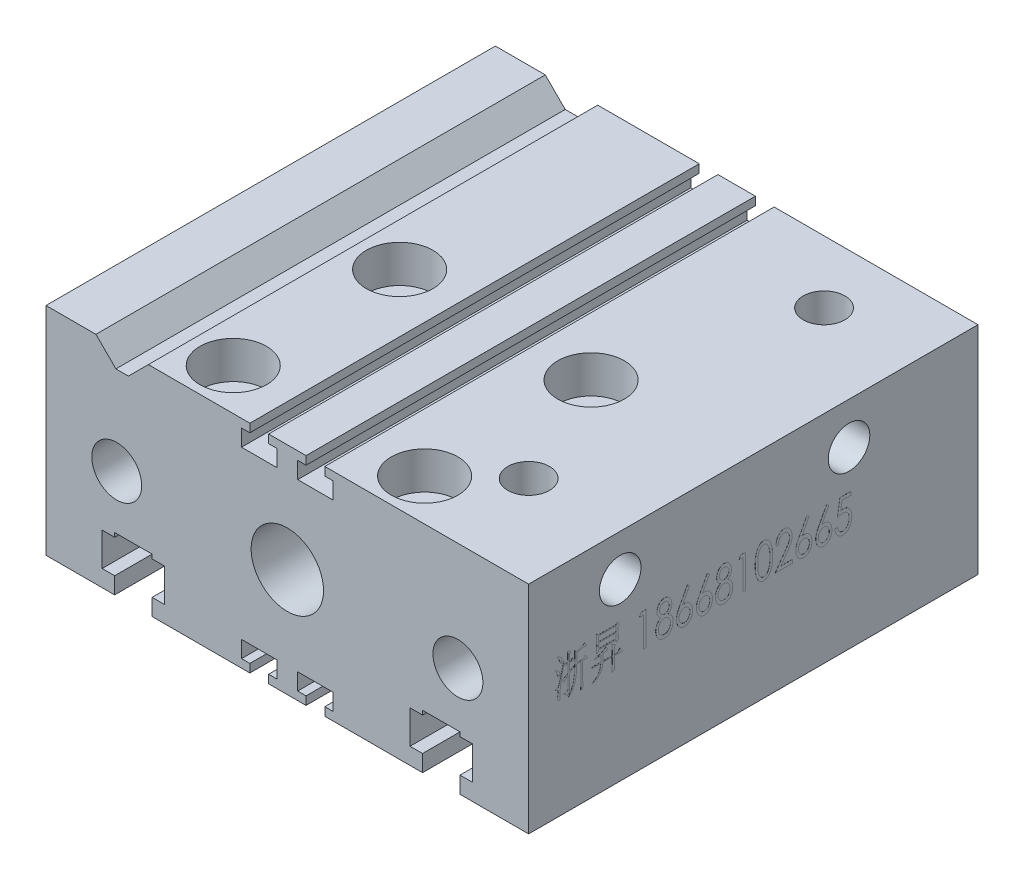
from build123d import *

# Parameters (mm, degrees)
SKETCH_4_R               = 3
EXTRUDE_1_DEPTH          = 54
CUT_EXTRUDE_1_DEPTH      = 63.657800791
SKETCH_6_R               = 4
CUT_EXTRUDE_2_DEPTH      = 4.5
SKETCH_7_R               = 2.25
CUT_EXTRUDE_3_DEPTH      = 21.5
EXTRUDE_2_DEPTH          = 54
SKETCH_9_R               = 2.5
CUT_EXTRUDE_4_DEPTH      = 5
SKETCH_10_R              = 2.5
CUT_EXTRUDE_5_DEPTH      = 5
SKETCH_11_R              = 4.35
CUT_EXTRUDE_6_DEPTH      = 46.5
SKETCH_12_R              = 1.5
CUT_EXTRUDE_7_DEPTH      = 3
SKETCH_13_R              = 1.5
EXTRUDE_4_DEPTH          = 3
SKETCH_14_R              = 1.5
CUT_EXTRUDE_8_DEPTH      = 6
CUT_EXTRUDE_9_DEPTH      = 3
EXTRUDE_START            = 5
SKETCH_16_W              = 56
SKETCH_16_H              = 22
EXTRUDE_5_DEPTH          = 8
SKETCH_18_R              = 3
EXTRUDE_6_DEPTH          = 67
SKETCH_19_R              = 4.35
EXTRUDE_7_DEPTH          = 59.5
SKETCH_20_R              = 2
CUT_EXTRUDE_10_DEPTH     = 8
MIRROR_4_COPY_1_SKETCH_R = 2
MIRROR_4_COPY_1_DEPTH    = 8
CUT_EXTRUDE_START        = -3
SKETCH_21_R              = 1.5
CUT_EXTRUDE_11_DEPTH     = 3
SKETCH_22_R              = 1.5
CUT_EXTRUDE_12_DEPTH     = 3
SKETCH_24_W              = 2.103628306
SKETCH_24_H              = 0.601036659
SKETCH_24_H_2            = 0.601036658
LOGO_DEPTH               = 0.01


with BuildPart() as part:
    # 草图4 → 凸台-拉伸1 (new body)
    with BuildSketch(Plane.XY):
        Polygon((-14.75, -7), (-16.25, -7), (-16.25, -6.5), (-20.75, -6.5), (-20.75, -7), (-22.25, -7), (-22.25, -11), (-20.75, -11), (-20.75, -13), (-29, -13), (-29, 13), (-23, 13), (-20.6, 10.6), (-19.1, 10.6), (-16.7, 13), (0, 13), (0, -13), (-16.25, -13), (-16.25, -11), (-14.75, -11), align=None)
        with Locations((-20.5, 0)):
            Circle(SKETCH_4_R, mode=Mode.SUBTRACT)
    extrude(amount=-EXTRUDE_1_DEPTH)

    # 草图5 → 切除-拉伸1 (cut, through all)
    with BuildSketch(Plane.XY):
        Polygon((-5.5, -12), (-4.5, -12), (-4.5, -13), (-2.25, -13), (-2.25, -12), (-1.25, -12), (-1.25, -10), (-5.5, -10), align=None)
    cut_extrude_1 = extrude(amount=-CUT_EXTRUDE_1_DEPTH, mode=Mode.SUBTRACT)

    # 镜向1: 切除-拉伸1 across plane
    add(cut_extrude_1.mirror(Plane.ZX), mode=Mode.SUBTRACT)

    # 草图6 → 切除-拉伸2 (cut)
    with BuildSketch(Plane(origin=(0, 13, 0), x_dir=(-1, 0, 0), z_dir=(0, 1, 0))):
        with Locations(Location((11.5, -25, 0), (0, 0, 90))):
            Circle(SKETCH_6_R)
        with Locations(Location((11.5, -5, 0), (0, 0, 90))):
            Circle(SKETCH_6_R)
    extrude(amount=-CUT_EXTRUDE_2_DEPTH, mode=Mode.SUBTRACT)

    # 草图7 → 切除-拉伸3 (cut)
    with BuildSketch(Plane(origin=(0, 8.5, 0), x_dir=(1, 0, 0), z_dir=(0, 1, 0))):
        with Locations(Location((-11.5, 25, 0), (0, 0, 270))):
            Circle(SKETCH_7_R)
        with Locations(Location((-11.5, 5, 0), (0, 0, 270))):
            Circle(SKETCH_7_R)
    extrude(amount=-CUT_EXTRUDE_3_DEPTH, mode=Mode.SUBTRACT)

    # 镜向2: part across plane


with BuildPart() as part_1:
    add(part.part)
    add(part.part.mirror(Plane(origin=(0, 0, 0), x_dir=(0, 0, 1), z_dir=(1, 0, 0))))

    # 草图8 → 凸台-拉伸2 (add)
    with BuildSketch(Plane.XY):
        Polygon((16.7, 13), (23, 13), (20.6, 10.6), (19.1, 10.6), align=None)
    extrude(amount=-EXTRUDE_2_DEPTH)

    # 草图9 → 切除-拉伸4 (cut)
    with BuildSketch(Plane(origin=(0, 13, 0), x_dir=(1, 0, 0), z_dir=(0, 1, 0))):
        with Locations(Location((18, 46.5, 0), (0, 0, 270))):
            Circle(SKETCH_9_R)
        with Locations(Location((18, 11, 0), (0, 0, 270))):
            Circle(SKETCH_9_R)
    extrude(amount=-CUT_EXTRUDE_4_DEPTH, mode=Mode.SUBTRACT)

    # 草图10 → 切除-拉伸5 (cut)
    with BuildSketch(Plane(origin=(29, 0, 0), x_dir=(0, 0, -1), z_dir=(1, 0, 0))):
        with Locations((11, 8)):
            Circle(SKETCH_10_R)
        with Locations((38.5, 8)):
            Circle(SKETCH_10_R)
    extrude(amount=-CUT_EXTRUDE_5_DEPTH, mode=Mode.SUBTRACT)

    # 草图11 → 切除-拉伸6 (cut)
    with BuildSketch(Plane.XY):
        Circle(SKETCH_11_R)
    extrude(amount=-CUT_EXTRUDE_6_DEPTH, mode=Mode.SUBTRACT)

    # 草图12 → 切除-拉伸7 (cut)
    with BuildSketch(Plane(origin=(0, 0, -54), x_dir=(-1, 0, 0), z_dir=(0, 0, -1))):
        with Locations((-11.5, 0)):
            Circle(SKETCH_12_R)
        with BuildLine():
            Line((11.75, 1.5), (11.25, 1.5))
            ThreePointArc((11.25, 1.5), (9.75, 0), (11.25, -1.5))
            Line((11.25, -1.5), (11.75, -1.5))
            ThreePointArc((11.75, -1.5), (13.25, 0), (11.75, 1.5))
        make_face()
    extrude(amount=-CUT_EXTRUDE_7_DEPTH, mode=Mode.SUBTRACT)

    # 草图13 → 凸台-拉伸4 (add)
    with BuildSketch(Plane(origin=(0, 0, -51), x_dir=(-1, 0, 0), z_dir=(0, 0, -1))):
        with Locations((11.5, 0)):
            Circle(SKETCH_13_R)
        with Locations((-11.5, 0)):
            Circle(SKETCH_13_R)
    extrude(amount=-EXTRUDE_4_DEPTH)

    # 草图14 → 切除-拉伸8 (cut)
    with BuildSketch(Plane.XZ.offset(13)):
        with Locations(Location((-11.5, -15, 0), (0, 0, 270))):
            Circle(SKETCH_14_R)
        with Locations(Location((11.5, -15, 0), (0, 0, 270))):
            Circle(SKETCH_14_R)
    extrude(amount=-CUT_EXTRUDE_8_DEPTH, mode=Mode.SUBTRACT)

    # 草图15 → 切除-拉伸9 (cut)
    with BuildSketch(Plane.XZ.offset(13)):
        with BuildLine():
            Line((-11.75, -13.5), (-11.25, -13.5))
            ThreePointArc((-11.25, -13.5), (-9.75, -15), (-11.25, -16.5))
            Line((-11.25, -16.5), (-11.75, -16.5))
            ThreePointArc((-11.75, -16.5), (-13.25, -15), (-11.75, -13.5))
        make_face()
    extrude(amount=-CUT_EXTRUDE_9_DEPTH, mode=Mode.SUBTRACT)

    # 草图24 → LOGO (add)
    # profile 1 of 18: a face of its own
    with BuildSketch(Plane(origin=(29, -8.271861505, -81.718145034), x_dir=(0, 0, -1), z_dir=(1, 0, 0))):
        with BuildLine():
            add(Edge.make_bspline(
                [(-77.516071716, 7.776919598), (-77.476862417, 7.773596407), (-77.403787341, 7.767402917), (-77.3019923, 7.760863494), (-77.216091646, 7.757671934), (-77.154314154, 7.753689482), (-77.111691447, 7.757773645), (-77.085022555, 7.769421649), (-77.062964179, 7.788872364), (-77.044139371, 7.814958211), (-77.031264485, 7.849268028), (-77.022195188, 7.890225485), (-77.015445302, 7.938361676), (-77.015290738, 7.972997722), (-77.015207834, 7.991575548)],
                knots=[0, 0, 0, 0, 2.100525425, 3.914786952, 5.444225465, 6.689422703, 7.217593918, 7.71170348, 8.213449184, 8.770928901, 9.411899069, 10.153063411, 11.009353811, 12, 12, 12, 12], degree=3))
            Line((-77.015207834, 7.991575548), (-77.015207834, 9.408304815))
            add(Edge.make_bspline(
                [(-77.015207834, 9.408304815), (-77.043422778, 9.387266192), (-77.098547395, 9.34616223), (-77.17663176, 9.283699881), (-77.248871537, 9.222876522), (-77.314938856, 9.163528184), (-77.37445757, 9.104732534), (-77.427831558, 9.047499974), (-77.475138672, 8.992020868), (-77.502768952, 8.954247797), (-77.516071716, 8.936061726)],
                knots=[0, 0, 0, 0, 1.222025073, 2.387517156, 3.471474562, 4.5008603, 5.470390012, 6.375415199, 7.217833885, 8, 8, 8, 8], degree=3))
            Line((-77.516071716, 8.936061726), (-77.666330881, 9.279511245))
            add(Edge.make_bspline(
                [(-77.666330881, 9.279511245), (-77.645812254, 9.287193115), (-77.602401867, 9.303445322), (-77.536176322, 9.334834194), (-77.462468324, 9.368103391), (-77.384378535, 9.409432137), (-77.299526845, 9.454248429), (-77.210501128, 9.506598685), (-77.1141654, 9.561917173), (-77.049018417, 9.602104154), (-77.015207834, 9.622960764)],
                knots=[0, 0, 0, 0, 0.712945484, 1.508348492, 2.38448197, 3.345261252, 4.383595111, 5.508266309, 6.706817039, 8, 8, 8, 8], degree=3))
            Line((-77.015207834, 9.622960764), (-77.015207834, 10.653309322))
            add(Edge.make_bspline(
                [(-77.015207834, 10.653309322), (-77.040953466, 10.652486454), (-77.094026718, 10.650790157), (-77.175753816, 10.63819891), (-77.261433923, 10.617293875), (-77.319283197, 10.598569188), (-77.349117089, 10.588912537)],
                knots=[0, 0, 0, 0, 0.904348783, 1.864266983, 2.898564786, 4, 4, 4, 4], degree=3))
            Line((-77.349117089, 10.588912537), (-77.499376253, 10.782102891))
            Line((-77.499376253, 10.782102891), (-77.015207834, 10.782102891))
            add(Edge.make_bspline(
                [(-77.015207834, 10.782102891), (-77.01515416, 10.860280044), (-77.01505227, 11.00868463), (-77.015731388, 11.219368407), (-77.017565121, 11.405930835), (-77.018903803, 11.568385219), (-77.021052993, 11.706468043), (-77.024571317, 11.820403827), (-77.027055594, 11.910293827), (-77.030460456, 11.962186314), (-77.031903297, 11.984176209)],
                knots=[0, 0, 0, 0, 1.560512955, 2.962339659, 4.205505168, 5.284691411, 6.205266357, 6.962014279, 7.560144476, 8, 8, 8, 8], degree=3))
            Line((-77.031903297, 11.984176209), (-76.681298579, 11.790985854))
            Line((-76.681298579, 11.790985854), (-76.798166818, 11.619261095))
            Line((-76.798166818, 11.619261095), (-76.798166818, 10.782102891))
            Line((-76.798166818, 10.782102891), (-76.614516728, 10.782102891))
            Line((-76.614516728, 10.782102891), (-76.447562101, 10.996758841))
            Line((-76.447562101, 10.996758841), (-76.230521085, 10.653309322))
            Line((-76.230521085, 10.653309322), (-76.798166818, 10.653309322))
            Line((-76.798166818, 10.653309322), (-76.798166818, 9.751754334))
            Line((-76.798166818, 9.751754334), (-76.297302936, 10.030807068))
            Line((-76.297302936, 10.030807068), (-76.280607473, 9.966410283))
            Line((-76.280607473, 9.966410283), (-76.798166818, 9.580029574))
            Line((-76.798166818, 9.580029574), (-76.798166818, 7.884247573))
            add(Edge.make_bspline(
                [(-76.798166818, 7.884247573), (-76.797917723, 7.851354694), (-76.797437677, 7.787964904), (-76.809376041, 7.696201747), (-76.832365085, 7.611781434), (-76.866618518, 7.534587897), (-76.912728163, 7.465108862), (-76.970014004, 7.403662778), (-77.037441615, 7.348495579), (-77.088913855, 7.319556719), (-77.11538061, 7.304676509)],
                knots=[0, 0, 0, 0, 1.122957731, 2.164117539, 3.150481994, 4.102973148, 5.037212324, 5.985605795, 6.964209066, 8, 8, 8, 8], degree=3))
            add(Edge.make_bspline(
                [(-77.11538061, 7.304676509), (-77.116637139, 7.327051557), (-77.119104632, 7.370990303), (-77.13768881, 7.434563453), (-77.170578178, 7.491752973), (-77.215248196, 7.543704881), (-77.273065162, 7.58881463), (-77.342340217, 7.629810962), (-77.424617939, 7.664368874), (-77.484597898, 7.681872424), (-77.516071716, 7.691057218)],
                knots=[0, 0, 0, 0, 0.89022321, 1.748165702, 2.607922575, 3.498208299, 4.458794142, 5.513651562, 6.695316228, 8, 8, 8, 8], degree=3))
            Line((-77.516071716, 7.691057218), (-77.516071716, 7.776919598))
        make_face()
    # profile 2 of 18: a face of its own
    with BuildSketch(Plane(origin=(29, -8.271861505, -81.718145034), x_dir=(0, 0, -1), z_dir=(1, 0, 0))):
        with BuildLine():
            Line((-76.180434697, 11.576329905), (-75.963393681, 11.38313955))
            add(Edge.make_bspline(
                [(-75.963393681, 11.38313955), (-75.921406203, 11.391087405), (-75.837089314, 11.40704784), (-75.711498541, 11.440980847), (-75.586477574, 11.483359368), (-75.461276012, 11.532184092), (-75.338846429, 11.590321072), (-75.219058933, 11.655171842), (-75.104191557, 11.729378978), (-75.03154633, 11.784675943), (-74.995056842, 11.812451449)],
                knots=[0, 0, 0, 0, 0.958228171, 1.924259856, 2.914849772, 3.918197784, 4.936592531, 5.952729694, 6.971662049, 8, 8, 8, 8], degree=3))
            Line((-74.995056842, 11.812451449), (-74.761320364, 11.42607074))
            add(Edge.make_bspline(
                [(-74.761320364, 11.42607074), (-74.8071576, 11.428706842), (-74.901741955, 11.434146394), (-75.048136199, 11.427131974), (-75.203027305, 11.411803141), (-75.308136247, 11.392893927), (-75.362357023, 11.38313955)],
                knots=[0, 0, 0, 0, 0.911147584, 1.880137538, 2.90646233, 4, 4, 4, 4], degree=3))
            add(Edge.make_bspline(
                [(-75.362357023, 11.38313955), (-75.416062936, 11.369764794), (-75.519902842, 11.343904821), (-75.671295494, 11.312873085), (-75.812460104, 11.290234098), (-75.903191103, 11.280485973), (-75.946698219, 11.275811575)],
                knots=[0, 0, 0, 0, 1.116635306, 2.15900443, 3.117210134, 4, 4, 4, 4], degree=3))
            Line((-75.946698219, 11.275811575), (-75.946698219, 10.202531828))
            Line((-75.946698219, 10.202531828), (-75.111925082, 10.202531828))
            Line((-75.111925082, 10.202531828), (-74.894884066, 10.481584562))
            Line((-74.894884066, 10.481584562), (-74.627756662, 10.073738258))
            Line((-74.627756662, 10.073738258), (-75.228793321, 10.073738258))
            Line((-75.228793321, 10.073738258), (-75.228793321, 8.013041143))
            add(Edge.make_bspline(
                [(-75.228793321, 8.013041143), (-75.228846522, 7.97302504), (-75.228949403, 7.895641969), (-75.228232107, 7.783273807), (-75.226373315, 7.678337286), (-75.225061454, 7.580804493), (-75.222747262, 7.490691794), (-75.219280294, 7.408029033), (-75.216492966, 7.33246794), (-75.213513914, 7.284531387), (-75.212097858, 7.261745319)],
                knots=[0, 0, 0, 0, 1.277791616, 2.470991278, 3.588129376, 4.629117088, 5.585682181, 6.466401277, 7.2710222, 8, 8, 8, 8], degree=3))
            Line((-75.212097858, 7.261745319), (-75.462529799, 7.13295175))
            add(Edge.make_bspline(
                [(-75.462529799, 7.13295175), (-75.460076518, 7.209006787), (-75.455341254, 7.355806396), (-75.449604802, 7.567806037), (-75.446197136, 7.763657577), (-75.445951799, 7.888751508), (-75.445834336, 7.948644358)],
                knots=[0, 0, 0, 0, 1.119166552, 2.16018843, 3.119129466, 4, 4, 4, 4], degree=3))
            Line((-75.445834336, 7.948644358), (-75.445834336, 10.073738258))
            Line((-75.445834336, 10.073738258), (-75.946698219, 10.073738258))
            add(Edge.make_bspline(
                [(-75.946698219, 10.073738258), (-75.947388754, 9.978054995), (-75.948734048, 9.791645987), (-75.961238162, 9.519921515), (-75.979211605, 9.26389783), (-76.007642335, 9.023733841), (-76.041742372, 8.799153467), (-76.084561892, 8.590264089), (-76.135210982, 8.397199334), (-76.19413371, 8.218820541), (-76.261461335, 8.053148944), (-76.332192877, 7.89589801), (-76.411599915, 7.748089935), (-76.495454034, 7.607728757), (-76.586224934, 7.476212855), (-76.683676175, 7.353496434), (-76.786794165, 7.238283882), (-76.86126355, 7.167962586), (-76.898339595, 7.13295175)],
                knots=[0, 0, 0, 0, 1.441396262, 2.808111263, 4.097231415, 5.307041974, 6.450466904, 7.518463093, 8.517840973, 9.455886127, 10.346272893, 11.21096725, 12.052190659, 12.872452488, 13.673136155, 14.457519185, 15.23204566, 16, 16, 16, 16], degree=3))
            Line((-76.898339595, 7.13295175), (-76.93173052, 7.197348534))
            add(Edge.make_bspline(
                [(-76.93173052, 7.197348534), (-76.901612753, 7.237317163), (-76.841100529, 7.317621608), (-76.75801836, 7.444137466), (-76.680630747, 7.57579095), (-76.609062572, 7.712735226), (-76.543019876, 7.855213222), (-76.482842722, 8.003087614), (-76.427617275, 8.155946137), (-76.37913358, 8.31496007), (-76.336195632, 8.48106638), (-76.298185124, 8.655328349), (-76.264695767, 8.838238526), (-76.237062124, 9.029988781), (-76.214892598, 9.230184633), (-76.198473295, 9.439135052), (-76.186525336, 9.656769352), (-76.177748975, 9.955751974), (-76.173893946, 10.326542397), (-76.170777535, 10.759839366), (-76.173172064, 11.174341013), (-76.178050431, 11.444360097), (-76.180434697, 11.576329905)],
                knots=[0, 0, 0, 0, 0.662389951, 1.330865231, 2.002353332, 2.683396512, 3.375607282, 4.080521521, 4.796291161, 5.526505572, 6.280421841, 7.066976656, 7.887227818, 8.741596789, 9.63112783, 10.553249083, 11.515961387, 12.516323991, 14.512741351, 16.424791296, 18.252643487, 20, 20, 20, 20], degree=3))
        make_face()
    # profile 3 of 18: a face of its own
    with BuildSketch(Plane(origin=(29, -8.271861505, -81.718145034), x_dir=(0, 0, -1), z_dir=(1, 0, 0))):
        with BuildLine():
            add(Edge.make_bspline(
                [(-77.449289865, 11.168483601), (-77.466698003, 11.076245338), (-77.500521119, 10.897031143), (-77.551104965, 10.636459675), (-77.596979493, 10.391497072), (-77.639833733, 10.162201391), (-77.680417796, 9.948662875), (-77.71802447, 9.751061269), (-77.751068341, 9.569103028), (-77.782392196, 9.403051722), (-77.810007413, 9.252487953), (-77.834721818, 9.117612923), (-77.856567359, 8.999000982), (-77.873289011, 8.895638402), (-77.889933959, 8.80872145), (-77.901708704, 8.736826693), (-77.910492955, 8.680912887), (-77.921458083, 8.603164081), (-77.932324098, 8.49238084), (-77.942530259, 8.337271714), (-77.948632953, 8.164675448), (-77.950350561, 8.012250984), (-77.950120246, 7.888487694), (-77.950161329, 7.801830349), (-77.950152719, 7.723387903), (-77.950151831, 7.653426836), (-77.950160707, 7.591942452), (-77.950132695, 7.538949042), (-77.950213646, 7.49413959), (-77.949932232, 7.448327392), (-77.951353443, 7.402955273), (-77.963222162, 7.361182481), (-77.984922064, 7.330511654), (-78.006458711, 7.327572102), (-78.016935598, 7.326142104)],
                knots=[0, 0, 0, 0, 2.29958923, 4.467983502, 6.502753265, 8.405114845, 10.182650034, 11.82777525, 13.332921769, 14.713231183, 15.967519949, 17.083022358, 18.072515711, 18.922112602, 19.647972212, 20.240337696, 20.706789336, 21.034569405, 22.163797951, 23.432603871, 24.842386934, 26.394165455, 27.166747456, 27.874406599, 28.517142885, 29.088464028, 29.588370029, 30.023353172, 30.386921172, 30.685566315, 31.147660195, 31.488489737, 31.751166687, 32, 32, 32, 32], degree=3))
            add(Edge.make_bspline(
                [(-78.016935598, 7.326142104), (-78.024151826, 7.327229284), (-78.042349175, 7.329970854), (-78.073245004, 7.343174464), (-78.112686745, 7.364893005), (-78.160853189, 7.389463186), (-78.208202157, 7.425578647), (-78.243468549, 7.475892514), (-78.263588174, 7.537514312), (-78.266056623, 7.58171907), (-78.26736754, 7.605194839)],
                knots=[0, 0, 0, 0, 0.427127334, 1.077098081, 1.953719219, 3.074763234, 4.248113902, 5.409025873, 6.624014476, 8, 8, 8, 8], degree=3))
            add(Edge.make_bspline(
                [(-78.26736754, 7.605194839), (-78.266702852, 7.627487008), (-78.265304838, 7.674373356), (-78.254946911, 7.746808607), (-78.240139372, 7.825052845), (-78.225137345, 7.877990839), (-78.217281151, 7.905713168)],
                knots=[0, 0, 0, 0, 0.875109498, 1.840587538, 2.869168669, 4, 4, 4, 4], degree=3))
            add(Edge.make_bspline(
                [(-78.217281151, 7.905713168), (-78.209492423, 7.939297026), (-78.195077221, 8.001453267), (-78.180308401, 8.08885394), (-78.169569223, 8.162511046), (-78.167929407, 8.207528913), (-78.167194763, 8.227697092)],
                knots=[0, 0, 0, 0, 1.267019699, 2.344971222, 3.258540696, 4, 4, 4, 4], degree=3))
            add(Edge.make_bspline(
                [(-78.167194763, 8.227697092), (-78.168111509, 8.251669523), (-78.169890447, 8.29818784), (-78.188020711, 8.364306296), (-78.216991835, 8.4240373), (-78.258681506, 8.476292374), (-78.311107879, 8.522179755), (-78.375429701, 8.560334932), (-78.450537955, 8.592329793), (-78.505635643, 8.60660216), (-78.534494943, 8.614077801)],
                knots=[0, 0, 0, 0, 0.985776299, 1.912891288, 2.80172221, 3.703935781, 4.648002657, 5.657446694, 6.773007504, 8, 8, 8, 8], degree=3))
            Line((-78.534494943, 8.614077801), (-78.534494943, 8.699940181))
            add(Edge.make_bspline(
                [(-78.534494943, 8.699940181), (-78.510416169, 8.696955285), (-78.464755441, 8.691295007), (-78.398754186, 8.688359933), (-78.339182884, 8.692675519), (-78.285287633, 8.700578878), (-78.2378405, 8.715796815), (-78.196462914, 8.736716217), (-78.161040258, 8.762894333), (-78.135118193, 8.791778922), (-78.116271093, 8.826422809), (-78.100112505, 8.869245752), (-78.078943149, 8.927924564), (-78.055655342, 9.003413312), (-78.028716408, 9.095401985), (-77.998754474, 9.203939863), (-77.964086792, 9.328490508), (-77.928315106, 9.470093467), (-77.88718819, 9.627819703), (-77.843644261, 9.80218226), (-77.797858438, 9.993461371), (-77.747625122, 10.200597762), (-77.694148766, 10.424481174), (-77.638268808, 10.665038432), (-77.577192792, 10.921819629), (-77.53686033, 11.098752472), (-77.516071716, 11.189949196)],
                knots=[0, 0, 0, 0, 0.600903889, 1.139497754, 1.632877501, 2.078541505, 2.485392867, 2.861139688, 3.222150147, 3.571022312, 3.812013988, 4.194747555, 4.703391174, 5.357307758, 6.150743804, 7.077615609, 8.146088831, 9.352833655, 10.694891418, 12.183375671, 13.804042793, 15.566402712, 17.462542123, 19.505253027, 21.683266767, 24, 24, 24, 24], degree=3))
            Line((-77.516071716, 11.189949196), (-77.449289865, 11.168483601))
        make_face()
    # profile 4 of 18: a face of its own
    with BuildSketch(Plane(origin=(29, -8.271861505, -81.718145034), x_dir=(0, 0, -1), z_dir=(1, 0, 0))):
        with BuildLine():
            add(Edge.make_bspline(
                [(-78.501104018, 10.674774917), (-78.462955464, 10.650778586), (-78.390380631, 10.605127324), (-78.291180912, 10.534350658), (-78.205938136, 10.467331384), (-78.133238162, 10.405684643), (-78.077445056, 10.344534742), (-78.034164601, 10.288297244), (-78.00458378, 10.2345762), (-77.987750026, 10.168514778), (-77.984661121, 10.09451257), (-77.984485927, 10.015220935), (-77.999122358, 9.94757704), (-78.022484697, 9.892639012), (-78.051077475, 9.8518262), (-78.073995817, 9.820693419), (-78.095535234, 9.800638829), (-78.110819234, 9.796421069), (-78.117108375, 9.794685524)],
                knots=[0, 0, 0, 0, 1.867629526, 3.553028491, 5.047159564, 6.362486976, 7.497363038, 8.470511233, 9.300771532, 10.017487337, 11.273512138, 12.361386287, 13.294215459, 14.120616262, 14.818225302, 15.349994229, 15.732532204, 16, 16, 16, 16], degree=3))
            add(Edge.make_bspline(
                [(-78.117108375, 9.794685524), (-78.128073369, 9.797384993), (-78.152930303, 9.803504517), (-78.180000979, 9.84228305), (-78.201682201, 9.896811133), (-78.211633447, 9.941211446), (-78.217281151, 9.966410283)],
                knots=[0, 0, 0, 0, 0.625753781, 1.418543377, 2.5349269, 4, 4, 4, 4], degree=3))
            add(Edge.make_bspline(
                [(-78.217281151, 9.966410283), (-78.223725981, 9.988726487), (-78.237170691, 10.035280844), (-78.261924366, 10.107082907), (-78.292859342, 10.183304498), (-78.331166097, 10.263504674), (-78.372475473, 10.349556083), (-78.421912399, 10.439338871), (-78.475344026, 10.534594951), (-78.514417753, 10.598835241), (-78.534494943, 10.631843727)],
                knots=[0, 0, 0, 0, 0.753685967, 1.572281956, 2.463374938, 3.421379192, 4.455951449, 5.56026366, 6.746394139, 8, 8, 8, 8], degree=3))
            Line((-78.534494943, 10.631843727), (-78.501104018, 10.674774917))
        make_face()
    # profile 5 of 18: a face of its own
    with BuildSketch(Plane(origin=(29, -8.271861505, -81.718145034), x_dir=(0, 0, -1), z_dir=(1, 0, 0))):
        with BuildLine():
            add(Edge.make_bspline(
                [(-78.233976614, 11.962710614), (-78.197310991, 11.940604965), (-78.127781602, 11.898685803), (-78.031113231, 11.837177347), (-77.94809853, 11.780360286), (-77.878132509, 11.730128422), (-77.821665681, 11.684901622), (-77.779386472, 11.644499939), (-77.749138401, 11.610044467), (-77.728990036, 11.570764568), (-77.719889492, 11.527268378), (-77.706936962, 11.482252655), (-77.701862403, 11.441550617), (-77.70039766, 11.416269995), (-77.699721806, 11.404605145)],
                knots=[0, 0, 0, 0, 1.892999102, 3.589713161, 5.065218099, 6.34020583, 7.397954074, 8.259798321, 8.925938809, 9.413302539, 10.192309411, 10.880050176, 11.48323873, 12, 12, 12, 12], degree=3))
            add(Edge.make_bspline(
                [(-77.699721806, 11.404605145), (-77.700677171, 11.386820693), (-77.702616982, 11.35071042), (-77.712526186, 11.296306555), (-77.732908851, 11.242737494), (-77.756836946, 11.191082476), (-77.783495465, 11.146323477), (-77.807293473, 11.112656103), (-77.82746439, 11.088483566), (-77.843619017, 11.084277599), (-77.849980971, 11.082621221)],
                knots=[0, 0, 0, 0, 1.156418317, 2.348038634, 3.573004282, 4.866549244, 6.047305203, 6.935690363, 7.580857662, 8, 8, 8, 8], degree=3))
            add(Edge.make_bspline(
                [(-77.849980971, 11.082621221), (-77.858478519, 11.085626246), (-77.879508677, 11.093063231), (-77.90018513, 11.131488263), (-77.919064208, 11.185081285), (-77.92822496, 11.229163075), (-77.933458285, 11.25434598)],
                knots=[0, 0, 0, 0, 0.527747406, 1.30609566, 2.461034846, 4, 4, 4, 4], degree=3))
            add(Edge.make_bspline(
                [(-77.933458285, 11.25434598), (-77.941229096, 11.276673632), (-77.957444728, 11.323265549), (-77.986452429, 11.394718688), (-78.019514307, 11.471093626), (-78.05915155, 11.551648753), (-78.103182784, 11.637278567), (-78.154024256, 11.727111462), (-78.208287351, 11.822339378), (-78.247337476, 11.886744149), (-78.26736754, 11.919779424)],
                knots=[0, 0, 0, 0, 0.76041172, 1.58677863, 2.48008943, 3.437109735, 4.474237527, 5.577180851, 6.75725827, 8, 8, 8, 8], degree=3))
            Line((-78.26736754, 11.919779424), (-78.233976614, 11.962710614))
        make_face()
    # profile 6 of 18: a face of its own
    with BuildSketch(Plane(origin=(29, -8.271861505, -81.718145034), x_dir=(0, 0, -1), z_dir=(1, 0, 0))):
        with BuildLine():
            add(Edge.make_bspline(
                [(-73.024992239, 9.558563979), (-73.095412319, 9.544648748), (-73.23281242, 9.517498053), (-73.434588504, 9.484529813), (-73.625358651, 9.452949617), (-73.74946743, 9.437342315), (-73.809678988, 9.429770409)],
                knots=[0, 0, 0, 0, 1.082922323, 2.112943312, 3.084491645, 4, 4, 4, 4], degree=3))
            Line((-73.809678988, 9.429770409), (-73.826374451, 9.515632789))
            add(Edge.make_bspline(
                [(-73.826374451, 9.515632789), (-73.78156357, 9.526397938), (-73.693942366, 9.54744763), (-73.565604634, 9.580066677), (-73.443569339, 9.61307926), (-73.328185181, 9.647614537), (-73.219074718, 9.681518804), (-73.116447941, 9.716430614), (-73.020374412, 9.752360288), (-72.930288876, 9.787878095), (-72.846725613, 9.824413015), (-72.769862268, 9.861632051), (-72.699241312, 9.899172883), (-72.635099846, 9.937200583), (-72.576703003, 9.97525629), (-72.524846577, 10.013923235), (-72.480037036, 10.053982964), (-72.453470476, 10.081787195), (-72.440651043, 10.095203853)],
                knots=[0, 0, 0, 0, 1.455470593, 2.84596247, 4.18193612, 5.447748209, 6.649518457, 7.790256621, 8.870729498, 9.888713581, 10.84814158, 11.750260656, 12.585238944, 13.373259508, 14.10447572, 14.785752985, 15.41407702, 16, 16, 16, 16], degree=3))
            Line((-72.440651043, 10.095203853), (-72.173523639, 9.708823144))
            add(Edge.make_bspline(
                [(-72.173523639, 9.708823144), (-72.188901855, 9.70845046), (-72.222632974, 9.707633001), (-72.277840191, 9.702561547), (-72.341680187, 9.693586911), (-72.414540434, 9.681445342), (-72.496180559, 9.666362812), (-72.58679235, 9.647929951), (-72.686289055, 9.626675281), (-72.755250529, 9.610132344), (-72.791255761, 9.601495169)],
                knots=[0, 0, 0, 0, 0.587766836, 1.289228427, 2.117117731, 3.051192682, 4.111965421, 5.289809149, 6.584991844, 8, 8, 8, 8], degree=3))
            add(Edge.make_bspline(
                [(-72.791255761, 9.601495169), (-72.791814935, 9.467385243), (-72.792919177, 9.202548489), (-72.802983396, 8.937901375), (-72.807951223, 8.807268156)],
                knots=[0, 0, 0, 0, 1.012774279, 2, 2, 2, 2], degree=3))
            Line((-72.807951223, 8.807268156), (-71.672659757, 8.807268156))
            add(Edge.make_bspline(
                [(-71.672659757, 8.807268156), (-71.672763628, 8.90479164), (-71.672973351, 9.10169896), (-71.676272018, 9.399577108), (-71.681970701, 9.702744203), (-71.686878739, 9.906520673), (-71.68935522, 10.009341473)],
                knots=[0, 0, 0, 0, 0.973425372, 1.965419753, 2.973398795, 4, 4, 4, 4], degree=3))
            Line((-71.68935522, 10.009341473), (-71.288664114, 9.751754334))
            Line((-71.288664114, 9.751754334), (-71.438923279, 9.622960764))
            Line((-71.438923279, 9.622960764), (-71.438923279, 8.807268156))
            Line((-71.438923279, 8.807268156), (-71.02153671, 8.807268156))
            Line((-71.02153671, 8.807268156), (-70.771104769, 9.12925208))
            Line((-70.771104769, 9.12925208), (-70.420500052, 8.678474586))
            Line((-70.420500052, 8.678474586), (-71.438923279, 8.678474586))
            add(Edge.make_bspline(
                [(-71.438923279, 8.678474586), (-71.438892792, 8.629713328), (-71.438833311, 8.534575873), (-71.439254673, 8.395709932), (-71.437784364, 8.264269984), (-71.438440481, 8.140507708), (-71.43727976, 8.024171626), (-71.436616311, 7.915517725), (-71.435665474, 7.81428684), (-71.435322673, 7.72046434), (-71.433069558, 7.634353618), (-71.432898542, 7.555628977), (-71.431008155, 7.48461505), (-71.429493431, 7.42101229), (-71.427927441, 7.365093118), (-71.42624685, 7.316867633), (-71.425048021, 7.276016769), (-71.423105802, 7.251405375), (-71.422227816, 7.240279724)],
                knots=[0, 0, 0, 0, 1.627151774, 3.174714603, 4.633872067, 6.013413788, 7.304553633, 8.516106521, 9.639229789, 10.682766767, 11.646839576, 12.513519877, 13.309605824, 14.017284162, 14.636561906, 15.176287955, 15.627638639, 16, 16, 16, 16], degree=3))
            Line((-71.422227816, 7.240279724), (-71.68935522, 7.068554965))
            add(Edge.make_bspline(
                [(-71.68935522, 7.068554965), (-71.684386807, 7.335144776), (-71.674386353, 7.871738499), (-71.673237725, 8.408424328), (-71.672659757, 8.678474586)],
                knots=[0, 0, 0, 0, 0.993637456, 2, 2, 2, 2], degree=3))
            Line((-71.672659757, 8.678474586), (-72.807951223, 8.678474586))
            add(Edge.make_bspline(
                [(-72.807951223, 8.678474586), (-72.812810553, 8.627502085), (-72.822343833, 8.52750163), (-72.84838024, 8.381811028), (-72.881458486, 8.242765912), (-72.923580216, 8.110352582), (-72.974812325, 7.984617204), (-73.033096505, 7.864572502), (-73.102162171, 7.752848845), (-73.177741902, 7.646577576), (-73.263332961, 7.548269533), (-73.356371667, 7.455809198), (-73.457833528, 7.369906698), (-73.56911497, 7.292648075), (-73.687489835, 7.219624105), (-73.815061633, 7.154844535), (-73.950740255, 7.096302908), (-74.045304271, 7.063704297), (-74.093501854, 7.04708937)],
                knots=[0, 0, 0, 0, 1.106023401, 2.169853196, 3.194860706, 4.192715704, 5.168892766, 6.126690055, 7.072446034, 8.003737069, 8.941624377, 9.88508921, 10.836049052, 11.80995603, 12.809731607, 13.839271887, 14.898715628, 16, 16, 16, 16], degree=3))
            Line((-74.093501854, 7.04708937), (-74.12689278, 7.13295175))
            add(Edge.make_bspline(
                [(-74.12689278, 7.13295175), (-74.086588064, 7.151187346), (-74.007360929, 7.187033129), (-73.895086815, 7.250016943), (-73.788812197, 7.316609341), (-73.689302431, 7.38893332), (-73.59676453, 7.46697969), (-73.511660039, 7.550613426), (-73.433300227, 7.639361039), (-73.361552813, 7.733224418), (-73.296908297, 7.832882183), (-73.240058623, 7.938225379), (-73.188342046, 8.047939738), (-73.146260985, 8.164131028), (-73.107988997, 8.284720303), (-73.079531579, 8.411488005), (-73.055658695, 8.542968965), (-73.046395722, 8.632811172), (-73.041687702, 8.678474586)],
                knots=[0, 0, 0, 0, 1.064766717, 2.093016002, 3.096817828, 4.083455538, 5.052478134, 6.009109113, 6.95398345, 7.900988624, 8.851470318, 9.810948989, 10.781651001, 11.769010699, 12.784267862, 13.825992316, 14.895033689, 16, 16, 16, 16], degree=3))
            Line((-73.041687702, 8.678474586), (-73.909851764, 8.678474586))
            Line((-73.909851764, 8.678474586), (-74.060110929, 8.635543396))
            Line((-74.060110929, 8.635543396), (-74.193674631, 8.807268156))
            Line((-74.193674631, 8.807268156), (-73.041687702, 8.807268156))
            add(Edge.make_bspline(
                [(-73.041687702, 8.807268156), (-73.036719946, 8.930745292), (-73.026648577, 9.181076368), (-73.025549295, 9.431608271), (-73.024992239, 9.558563979)],
                knots=[0, 0, 0, 0, 0.986510643, 2, 2, 2, 2], degree=3))
        make_face()
    # profile 7 of 18: a face of its own
    with BuildSketch(Plane(origin=(29, -8.271861505, -81.718145034), x_dir=(0, 0, -1), z_dir=(1, 0, 0))):
        with BuildLine():
            add(Edge.make_bspline(
                [(-73.559247047, 9.902013498), (-73.557835799, 9.933546215), (-73.55491901, 9.998718503), (-73.55212026, 10.099445211), (-73.548623037, 10.206492131), (-73.546311859, 10.319922705), (-73.544984344, 10.439978935), (-73.543129188, 10.566117047), (-73.542402855, 10.698624871), (-73.542642518, 10.979536914), (-73.544525378, 11.40892051), (-73.554323645, 11.791792112), (-73.559247047, 11.984176209)],
                knots=[0, 0, 0, 0, 0.454689181, 0.939758344, 1.451537799, 1.997567454, 2.574067944, 3.181106284, 3.814830949, 4.482902058, 7.227786299, 10, 10, 10, 10], degree=3))
            Line((-73.559247047, 11.984176209), (-73.308815106, 11.812451449))
            Line((-73.308815106, 11.812451449), (-71.221882263, 11.812451449))
            Line((-71.221882263, 11.812451449), (-71.071623098, 12.005641804))
            Line((-71.071623098, 12.005641804), (-70.804495695, 11.705123474))
            Line((-70.804495695, 11.705123474), (-70.971450322, 11.55486431))
            add(Edge.make_bspline(
                [(-70.971450322, 11.55486431), (-70.971419761, 11.506898075), (-70.971360157, 11.413350668), (-70.971781971, 11.276869754), (-70.970312339, 11.147814937), (-70.970966303, 11.026172665), (-70.969806899, 10.91169166), (-70.969144079, 10.804627782), (-70.968192379, 10.704986988), (-70.96785169, 10.612754319), (-70.965588286, 10.527969074), (-70.965435763, 10.450568872), (-70.963527755, 10.38061545), (-70.962005641, 10.317807984), (-70.960474486, 10.262417769), (-70.958757895, 10.214458427), (-70.957576593, 10.173872034), (-70.955633321, 10.149260677), (-70.954754859, 10.138135043)],
                knots=[0, 0, 0, 0, 1.624868067, 3.168941589, 4.623271101, 5.996778362, 7.289522249, 8.501473668, 9.623656031, 10.665046635, 11.625771784, 12.496603706, 13.28679881, 13.996222603, 14.624881056, 15.163810511, 15.621998175, 16, 16, 16, 16], degree=3))
            Line((-70.954754859, 10.138135043), (-71.2051868, 9.966410283))
            Line((-71.2051868, 9.966410283), (-71.2051868, 10.223997423))
            Line((-71.2051868, 10.223997423), (-73.308815106, 10.223997423))
            Line((-73.308815106, 10.223997423), (-73.308815106, 10.073738258))
            Line((-73.308815106, 10.073738258), (-73.559247047, 9.902013498))
        make_face()
        with Locations((-72.257000953, 10.653309322)):
            Rectangle(SKETCH_24_W, SKETCH_24_H, mode=Mode.SUBTRACT)
        with Locations((-72.257000953, 11.38313955)):
            Rectangle(SKETCH_24_W, SKETCH_24_H_2, mode=Mode.SUBTRACT)
    # profile 8 of 18: a face of its own
    with BuildSketch(Plane(origin=(29, -8.271861505, -81.718145034), x_dir=(0, 0, -1), z_dir=(1, 0, 0))):
        Polygon((-68.215108926, 11.573944839), (-67.625997598, 11.573944839), (-67.625997598, 7.605194839), (-67.931286059, 7.605194839), (-67.931286059, 11.166893557), (-68.389218751, 11.166893557), align=None)
    # profile 9 of 18: a face of its own
    with BuildSketch(Plane(origin=(29, -8.271861505, -81.718145034), x_dir=(0, 0, -1), z_dir=(1, 0, 0))):
        with BuildLine():
            add(Edge.make_bspline(
                [(-64.960288713, 9.816151119), (-64.911205327, 9.782275906), (-64.816376854, 9.71682943), (-64.692094438, 9.603416432), (-64.588386835, 9.483524957), (-64.50680495, 9.354901241), (-64.444985276, 9.218814334), (-64.401166889, 9.074230112), (-64.374333989, 8.920628244), (-64.371191873, 8.815063747), (-64.369587341, 8.761156878)],
                knots=[0, 0, 0, 0, 1.128817125, 2.180860238, 3.177988592, 4.123737061, 5.056171269, 6.001159785, 6.979285454, 8, 8, 8, 8], degree=3))
            add(Edge.make_bspline(
                [(-64.369587341, 8.761156878), (-64.370479437, 8.722976627), (-64.372242056, 8.647539453), (-64.382385665, 8.535886838), (-64.400741051, 8.427777587), (-64.426443023, 8.322896407), (-64.458607524, 8.221471316), (-64.498931645, 8.123463052), (-64.546264651, 8.029093473), (-64.583268645, 7.969060679), (-64.601733776, 7.939104093)],
                knots=[0, 0, 0, 0, 1.057772661, 2.089964817, 3.102547595, 4.092524029, 5.079228706, 6.047156722, 7.025523981, 8, 8, 8, 8], degree=3))
            add(Edge.make_bspline(
                [(-64.601733776, 7.939104093), (-64.626155227, 7.904591819), (-64.673992754, 7.836988064), (-64.757118859, 7.747571346), (-64.847909673, 7.671454925), (-64.947180956, 7.610129148), (-65.053821234, 7.562050885), (-65.167847593, 7.52752401), (-65.289797321, 7.507708186), (-65.373628226, 7.504881854), (-65.416631362, 7.503432018)],
                knots=[0, 0, 0, 0, 1.048906327, 2.054631539, 3.021839926, 3.982309668, 4.942418687, 5.918716991, 6.932354415, 8, 8, 8, 8], degree=3))
            add(Edge.make_bspline(
                [(-65.416631362, 7.503432018), (-65.458029312, 7.504731001), (-65.538557471, 7.507257809), (-65.655818093, 7.524648558), (-65.764847219, 7.554976776), (-65.866723932, 7.596396915), (-65.960292854, 7.651168723), (-66.046463876, 7.717245321), (-66.124718712, 7.795614466), (-66.19339004, 7.885248305), (-66.25462082, 7.981428096), (-66.308084237, 8.081203764), (-66.353511702, 8.183237466), (-66.391227604, 8.287531551), (-66.419734767, 8.394540151), (-66.440316214, 8.503746523), (-66.453695692, 8.615335492), (-66.455045225, 8.690626847), (-66.455725162, 8.728560974)],
                knots=[0, 0, 0, 0, 1.104708739, 2.14890257, 3.154370595, 4.118367704, 5.075413289, 6.038709714, 7.008861323, 8.021763411, 9.045837506, 10.048840199, 11.039777576, 12.024055369, 13.005330523, 13.991512021, 14.988061252, 16, 16, 16, 16], degree=3))
            add(Edge.make_bspline(
                [(-66.455725162, 8.728560974), (-66.454097946, 8.783518338), (-66.4509105, 8.891170681), (-66.424324097, 9.048354753), (-66.379135262, 9.196488112), (-66.32823293, 9.313822908), (-66.277582045, 9.402771619), (-66.233389333, 9.46736354), (-66.184052157, 9.530607618), (-66.128104679, 9.591297794), (-66.067858968, 9.651308765), (-66.001266043, 9.708689164), (-65.92932124, 9.764153078), (-65.878201669, 9.798666105), (-65.852303437, 9.816151119)],
                knots=[0, 0, 0, 0, 1.517674003, 2.972871206, 4.388029641, 5.787820883, 6.496147795, 7.212975084, 7.948222945, 8.710108948, 9.49185787, 10.296315951, 11.136878426, 12, 12, 12, 12], degree=3))
            add(Edge.make_bspline(
                [(-65.852303437, 9.816151119), (-65.888325583, 9.841430209), (-65.959072841, 9.891078177), (-66.050372961, 9.980829774), (-66.129859408, 10.077369381), (-66.193084227, 10.183637035), (-66.242466691, 10.295897262), (-66.277634106, 10.412824635), (-66.298864906, 10.533812986), (-66.301666424, 10.615858876), (-66.303080931, 10.657284432)],
                knots=[0, 0, 0, 0, 1.058972266, 2.079814596, 3.074322664, 4.065626078, 5.049411374, 6.023340544, 7.001970524, 8, 8, 8, 8], degree=3))
            add(Edge.make_bspline(
                [(-66.303080931, 10.657284432), (-66.301879727, 10.699543415), (-66.299474293, 10.784167886), (-66.274336588, 10.909718876), (-66.23878488, 11.034538638), (-66.185597064, 11.155041653), (-66.122172346, 11.269833421), (-66.04406766, 11.372417488), (-65.955196791, 11.462414829), (-65.855886054, 11.538463949), (-65.749045458, 11.600334743), (-65.635581999, 11.643040865), (-65.518405706, 11.67084519), (-65.438517677, 11.674080685), (-65.398345855, 11.675707659)],
                knots=[0, 0, 0, 0, 1.006801535, 2.016140496, 3.04434944, 4.097767983, 5.150882958, 6.16620321, 7.163091172, 8.159497914, 9.142029795, 10.096562843, 11.042853592, 12, 12, 12, 12], degree=3))
            add(Edge.make_bspline(
                [(-65.398345855, 11.675707659), (-65.358981164, 11.674051373), (-65.280947825, 11.670768086), (-65.166441829, 11.643584834), (-65.057429172, 11.598263484), (-64.954095166, 11.536660016), (-64.857762964, 11.460751681), (-64.772676772, 11.36969872), (-64.696960526, 11.267494638), (-64.635304747, 11.153242403), (-64.585316064, 11.031944198), (-64.548501567, 10.906266115), (-64.526318378, 10.777058843), (-64.52359935, 10.689965517), (-64.522231572, 10.646154123)],
                knots=[0, 0, 0, 0, 0.945268751, 1.87382339, 2.810620796, 3.772987939, 4.756784404, 5.747996242, 6.759505551, 7.805656055, 8.859553138, 9.907698875, 10.947489625, 12, 12, 12, 12], degree=3))
            add(Edge.make_bspline(
                [(-64.522231572, 10.646154123), (-64.52371225, 10.603157938), (-64.526607709, 10.519079073), (-64.546176051, 10.396198048), (-64.581852909, 10.281134416), (-64.62966537, 10.17278241), (-64.691104155, 10.071486803), (-64.768407759, 9.978992559), (-64.856953684, 9.891304313), (-64.92539124, 9.84153125), (-64.960288713, 9.816151119)],
                knots=[0, 0, 0, 0, 1.053501153, 2.060117211, 3.037794984, 3.997036466, 4.955838333, 5.929389179, 6.944160328, 8, 8, 8, 8], degree=3))
        make_face()
        with BuildLine():
            add(Edge.make_bspline(
                [(-65.413451274, 11.268656377), (-65.43414035, 11.267923699), (-65.474609939, 11.26649052), (-65.534167953, 11.258811075), (-65.590779634, 11.244095006), (-65.645269986, 11.224672559), (-65.696098241, 11.197609183), (-65.745305897, 11.166999191), (-65.790572153, 11.128895389), (-65.847021975, 11.072531336), (-65.907390136, 10.993344777), (-65.959923238, 10.887373362), (-65.99224357, 10.772319472), (-65.995917218, 10.692476124), (-65.997792469, 10.651719278)],
                knots=[0, 0, 0, 0, 0.787074358, 1.539584277, 2.277719126, 3.007830531, 3.733477235, 4.463101644, 5.207606632, 5.977196966, 7.494883027, 8.968605234, 10.452593816, 12, 12, 12, 12], degree=3))
            add(Edge.make_bspline(
                [(-65.997792469, 10.651719278), (-65.995705628, 10.610933609), (-65.991555282, 10.529818381), (-65.956218466, 10.411678976), (-65.899830092, 10.299641816), (-65.834954845, 10.214450322), (-65.775783906, 10.151512432), (-65.728224335, 10.110034487), (-65.678165928, 10.075456343), (-65.62678204, 10.046935598), (-65.573618916, 10.024081932), (-65.518585078, 10.008358684), (-65.461516369, 9.998355661), (-65.422768508, 9.997204817), (-65.403115987, 9.996621121)],
                knots=[0, 0, 0, 0, 1.503377697, 2.989943038, 4.512810598, 6.113657223, 6.923460787, 7.700377033, 8.438683534, 9.16575144, 9.867283722, 10.570247634, 11.274844133, 12, 12, 12, 12], degree=3))
            add(Edge.make_bspline(
                [(-65.403115987, 9.996621121), (-65.378098969, 9.997622804), (-65.327976398, 9.999629715), (-65.254305067, 10.018157768), (-65.182817321, 10.046978097), (-65.114483906, 10.087119435), (-65.050311175, 10.136551685), (-64.993656665, 10.196271359), (-64.943790947, 10.263719261), (-64.90228098, 10.338715816), (-64.869595559, 10.417871629), (-64.845228159, 10.498214376), (-64.830341118, 10.578817619), (-64.828456037, 10.632843782), (-64.827520034, 10.659669498)],
                knots=[0, 0, 0, 0, 0.926959826, 1.857200198, 2.801319747, 3.77959719, 4.788725481, 5.797230661, 6.823935113, 7.893723746, 8.969417254, 9.996121706, 11.005010385, 12, 12, 12, 12], degree=3))
            add(Edge.make_bspline(
                [(-64.827520034, 10.659669498), (-64.829384828, 10.696941276), (-64.833087637, 10.770949585), (-64.862077695, 10.879303783), (-64.910168193, 10.982417231), (-64.964189175, 11.063051301), (-65.016443641, 11.122110822), (-65.060555885, 11.161609709), (-65.109020872, 11.194751986), (-65.161594389, 11.222708661), (-65.218891697, 11.242585157), (-65.279976287, 11.258229981), (-65.34537419, 11.266690574), (-65.390374045, 11.267989996), (-65.413451274, 11.268656377)],
                knots=[0, 0, 0, 0, 1.41789026, 2.815418751, 4.237647105, 5.734964885, 6.492513555, 7.235814941, 7.983146572, 8.723359292, 9.495815479, 10.286317727, 11.121174114, 12, 12, 12, 12], degree=3))
        make_face(mode=Mode.SUBTRACT)
        with BuildLine():
            add(Edge.make_bspline(
                [(-65.396755811, 9.589569839), (-65.423058851, 9.58894987), (-65.474663449, 9.587733539), (-65.55015499, 9.573834405), (-65.622829545, 9.554829055), (-65.692052055, 9.525368276), (-65.758036466, 9.48815889), (-65.820455222, 9.441925803), (-65.880285851, 9.388873376), (-65.935295539, 9.327586609), (-65.985690014, 9.261728146), (-66.029718795, 9.191949726), (-66.067251962, 9.119714102), (-66.097508782, 9.044280795), (-66.121596702, 8.966432726), (-66.137992834, 8.885452114), (-66.14887837, 8.80200071), (-66.149913591, 8.745291504), (-66.1504367, 8.716635644)],
                knots=[0, 0, 0, 0, 0.9847572, 1.932020036, 2.869543467, 3.795734653, 4.743309996, 5.703045184, 6.702129772, 7.735926045, 8.785026717, 9.807544264, 10.825030468, 11.832280622, 12.85044557, 13.875276944, 14.92635129, 16, 16, 16, 16], degree=3))
            add(Edge.make_bspline(
                [(-66.1504367, 8.716635644), (-66.149493494, 8.681040567), (-66.147630419, 8.610731169), (-66.128850753, 8.506879229), (-66.100922818, 8.405764228), (-66.059955322, 8.309201754), (-66.010483724, 8.218760739), (-65.948630969, 8.139372271), (-65.879710668, 8.069056766), (-65.800070957, 8.011864737), (-65.713277162, 7.965939442), (-65.618893654, 7.934633563), (-65.518529606, 7.913561017), (-65.449075651, 7.911526729), (-65.413451274, 7.9104833)],
                knots=[0, 0, 0, 0, 1.046503232, 2.067112015, 3.096621624, 4.12790218, 5.147527128, 6.120914979, 7.080488514, 8.035200521, 8.994520469, 9.958867953, 10.953060937, 12, 12, 12, 12], degree=3))
            add(Edge.make_bspline(
                [(-65.413451274, 7.9104833), (-65.385842604, 7.91119737), (-65.331945455, 7.912591364), (-65.253320005, 7.924940489), (-65.179032064, 7.944490014), (-65.109418846, 7.972905185), (-65.043269499, 8.007777242), (-64.982363427, 8.051977419), (-64.924886717, 8.103076687), (-64.874382041, 8.162981966), (-64.827350002, 8.226712137), (-64.787165523, 8.2947128), (-64.751516856, 8.364420801), (-64.724194443, 8.437482252), (-64.701075333, 8.512393305), (-64.686809553, 8.590614425), (-64.676531759, 8.671312542), (-64.675433745, 8.726141158), (-64.674875803, 8.75400168)],
                knots=[0, 0, 0, 0, 1.057208993, 2.063864431, 3.041686247, 3.993867019, 4.938765438, 5.899569259, 6.870141775, 7.877872017, 8.895376391, 9.901878192, 10.900874436, 11.890851383, 12.886746751, 13.900342611, 14.933083623, 16, 16, 16, 16], degree=3))
            add(Edge.make_bspline(
                [(-64.674875803, 8.75400168), (-64.675360718, 8.781075518), (-64.676315251, 8.83436919), (-64.687683621, 8.9129259), (-64.702891258, 8.989491059), (-64.726185944, 9.063783293), (-64.756649403, 9.135461548), (-64.793346331, 9.204885907), (-64.836493113, 9.271865497), (-64.885417043, 9.33566472), (-64.938634017, 9.394970796), (-64.996047342, 9.446762609), (-65.055892386, 9.490869362), (-65.118425089, 9.527158004), (-65.184103944, 9.555212581), (-65.252732224, 9.574963371), (-65.323961478, 9.587355236), (-65.372324814, 9.588826581), (-65.396755811, 9.589569839)],
                knots=[0, 0, 0, 0, 1.062772706, 2.092021773, 3.112970097, 4.127207538, 5.144326494, 6.168931198, 7.208606358, 8.270613836, 9.324630021, 10.334529776, 11.302840154, 12.240380969, 13.168626316, 14.101066092, 15.040743392, 16, 16, 16, 16], degree=3))
        make_face(mode=Mode.SUBTRACT)
    # profile 10 of 18: a face of its own
    with BuildSketch(Plane(origin=(29, -8.271861505, -81.718145034), x_dir=(0, 0, -1), z_dir=(1, 0, 0))):
        with BuildLine():
            Line((-62.639619393, 11.675707659), (-62.393162562, 11.443561225))
            Line((-62.393162562, 11.443561225), (-63.243041117, 9.845566934))
            add(Edge.make_bspline(
                [(-63.243041117, 9.845566934), (-63.215557647, 9.85302857), (-63.161738285, 9.867640281), (-63.081388658, 9.883922701), (-63.002878209, 9.892708497), (-62.951287301, 9.894147939), (-62.925827325, 9.8948583)],
                knots=[0, 0, 0, 0, 1.060929787, 2.077560185, 3.051281057, 4, 4, 4, 4], degree=3))
            add(Edge.make_bspline(
                [(-62.925827325, 9.8948583), (-62.89501395, 9.893772185), (-62.834294968, 9.891631952), (-62.745393943, 9.875154205), (-62.660032646, 9.848956288), (-62.578574884, 9.810949546), (-62.500305713, 9.763103751), (-62.425740332, 9.704268507), (-62.355058877, 9.63481172), (-62.28880885, 9.555522827), (-62.228193551, 9.468805075), (-62.17446234, 9.376472572), (-62.130259178, 9.278656764), (-62.092264482, 9.176660323), (-62.063765169, 9.069059055), (-62.044545486, 8.956460948), (-62.030933905, 8.839398802), (-62.029680187, 8.759607494), (-62.029042469, 8.71902071)],
                knots=[0, 0, 0, 0, 0.901205013, 1.775860311, 2.636794131, 3.507728647, 4.39883402, 5.315685146, 6.280851143, 7.293630634, 8.33489768, 9.373736179, 10.414743294, 11.472171862, 12.555667919, 13.666163363, 14.812866618, 16, 16, 16, 16], degree=3))
            add(Edge.make_bspline(
                [(-62.029042469, 8.71902071), (-62.030484118, 8.663539397), (-62.033312361, 8.55469551), (-62.058035469, 8.395948886), (-62.096543531, 8.244727401), (-62.15230457, 8.10335147), (-62.220890859, 7.972221317), (-62.304452838, 7.854902385), (-62.401206768, 7.75161887), (-62.509786513, 7.663563385), (-62.627173244, 7.592601141), (-62.750784395, 7.540904996), (-62.879490733, 7.509533202), (-62.966999595, 7.5054701), (-63.010894683, 7.503432018)],
                knots=[0, 0, 0, 0, 1.1494067, 2.254919458, 3.322155787, 4.377964422, 5.397776209, 6.382466747, 7.354045797, 8.32263862, 9.271321606, 10.187430282, 11.090801708, 12, 12, 12, 12], degree=3))
            add(Edge.make_bspline(
                [(-63.010894683, 7.503432018), (-63.053474054, 7.505147614), (-63.137826298, 7.508546312), (-63.261604055, 7.539607758), (-63.380130614, 7.589519951), (-63.493203744, 7.657986476), (-63.59736172, 7.744878698), (-63.690244686, 7.848863723), (-63.771716029, 7.968315856), (-63.840168877, 8.10225226), (-63.894297788, 8.246437508), (-63.93330366, 8.397282477), (-63.958121195, 8.552835093), (-63.961054735, 8.658505878), (-63.962536059, 8.711865512)],
                knots=[0, 0, 0, 0, 0.896664654, 1.776345551, 2.673079863, 3.600831316, 4.55320042, 5.522713429, 6.531813274, 7.594061508, 8.687030288, 9.772760072, 10.875330519, 12, 12, 12, 12], degree=3))
            add(Edge.make_bspline(
                [(-63.962536059, 8.711865512), (-63.961642472, 8.752721634), (-63.959820426, 8.836028275), (-63.943795779, 8.962204368), (-63.919031949, 9.09149859), (-63.884262018, 9.225771482), (-63.836680917, 9.368332886), (-63.77253959, 9.521924714), (-63.694952803, 9.689888895), (-63.634240688, 9.8045147), (-63.602391077, 9.864647463)],
                knots=[0, 0, 0, 0, 0.803132881, 1.63760775, 2.497139017, 3.390748782, 4.363024246, 5.449780174, 6.662153211, 8, 8, 8, 8], degree=3))
            Line((-63.602391077, 9.864647463), (-62.639619393, 11.675707659))
        make_face()
        with BuildLine():
            add(Edge.make_bspline(
                [(-62.995789264, 9.487807018), (-63.018347999, 9.486930536), (-63.062641415, 9.48520959), (-63.128162595, 9.474900633), (-63.19062292, 9.456281718), (-63.251271667, 9.431742984), (-63.308568175, 9.398552049), (-63.363702222, 9.358863961), (-63.415554666, 9.311036687), (-63.464999471, 9.257825915), (-63.510458188, 9.199299173), (-63.548940097, 9.136211124), (-63.582980463, 9.070894143), (-63.609767418, 9.001977523), (-63.6315416, 8.930302852), (-63.646446701, 8.855477882), (-63.655333476, 8.777537688), (-63.656600135, 8.724609702), (-63.657247598, 8.697555115)],
                knots=[0, 0, 0, 0, 0.946268867, 1.857971231, 2.772378949, 3.674274847, 4.595075925, 5.54206238, 6.517636006, 7.547827487, 8.585901374, 9.619025919, 10.642903972, 11.670634825, 12.714877187, 13.780659826, 14.865565546, 16, 16, 16, 16], degree=3))
            add(Edge.make_bspline(
                [(-63.657247598, 8.697555115), (-63.656607006, 8.6707638), (-63.655354032, 8.618360926), (-63.646344095, 8.540975116), (-63.631697055, 8.466614093), (-63.609566413, 8.395320633), (-63.583211822, 8.326750401), (-63.548696669, 8.261939079), (-63.510491837, 8.198972826), (-63.464987161, 8.140475584), (-63.415569852, 8.087228007), (-63.363656585, 8.03951171), (-63.308834727, 7.99951087), (-63.250835524, 7.967707975), (-63.190857374, 7.941734163), (-63.128126376, 7.923470639), (-63.062650859, 7.913059618), (-63.018351186, 7.911352659), (-62.995789264, 7.9104833)],
                knots=[0, 0, 0, 0, 1.126413976, 2.203226288, 3.27193519, 4.308375719, 5.338928357, 6.355711774, 7.391672913, 8.432596984, 9.465617006, 10.443869212, 11.393455756, 12.311321693, 13.22000908, 14.136927438, 15.051133013, 16, 16, 16, 16], degree=3))
            add(Edge.make_bspline(
                [(-62.995789264, 7.9104833), (-62.973231091, 7.911363828), (-62.928938778, 7.913092718), (-62.863661637, 7.923304274), (-62.801131016, 7.942116913), (-62.741062002, 7.967264286), (-62.683390572, 7.999756587), (-62.628699273, 8.039761818), (-62.576008685, 8.086693656), (-62.527411693, 8.140763998), (-62.481957232, 8.199169188), (-62.442760115, 8.261701224), (-62.408417295, 8.326780941), (-62.381998411, 8.39531236), (-62.35988528, 8.466616391), (-62.345233399, 8.540974491), (-62.33622477, 8.618361091), (-62.334971615, 8.670763856), (-62.334330931, 8.697555115)],
                knots=[0, 0, 0, 0, 0.949074805, 1.863480608, 2.76990316, 3.689052114, 4.597391575, 5.547186095, 6.533934344, 7.559637911, 8.600789962, 9.642896214, 10.659902324, 11.690680672, 12.727348199, 13.796291166, 14.87333932, 16, 16, 16, 16], degree=3))
            add(Edge.make_bspline(
                [(-62.334330931, 8.697555115), (-62.334978488, 8.724609645), (-62.336245329, 8.777537521), (-62.345130782, 8.855478513), (-62.360040743, 8.930300548), (-62.381797272, 9.00198588), (-62.408648763, 9.07086353), (-62.442513844, 9.136450619), (-62.481990752, 9.199102892), (-62.527399483, 9.257537423), (-62.576023971, 9.311571091), (-62.628652628, 9.358614898), (-62.683659324, 9.398307806), (-62.740625112, 9.432185974), (-62.801361313, 9.455903841), (-62.863626032, 9.475066112), (-62.928948107, 9.48517662), (-62.973234239, 9.486919411), (-62.995789264, 9.487807018)],
                knots=[0, 0, 0, 0, 1.134674697, 2.21981017, 3.285818513, 4.330282017, 5.358230516, 6.382325399, 7.421570703, 8.459864426, 9.482752076, 10.466791355, 11.413978355, 12.325331643, 13.237701197, 14.141635301, 15.053530739, 16, 16, 16, 16], degree=3))
        make_face(mode=Mode.SUBTRACT)
    # profile 11 of 18: a face of its own
    with BuildSketch(Plane(origin=(29, -8.271861505, -81.718145034), x_dir=(0, 0, -1), z_dir=(1, 0, 0))):
        with BuildLine():
            Line((-60.24819311, 11.675707659), (-60.00173628, 11.443561225))
            Line((-60.00173628, 11.443561225), (-60.851614835, 9.845566934))
            add(Edge.make_bspline(
                [(-60.851614835, 9.845566934), (-60.824131365, 9.85302857), (-60.770312003, 9.867640281), (-60.689962376, 9.883922701), (-60.611451927, 9.892708497), (-60.559861019, 9.894147939), (-60.534401043, 9.8948583)],
                knots=[0, 0, 0, 0, 1.060929787, 2.077560185, 3.051281057, 4, 4, 4, 4], degree=3))
            add(Edge.make_bspline(
                [(-60.534401043, 9.8948583), (-60.503587667, 9.893772185), (-60.442868685, 9.891631952), (-60.353967661, 9.875154205), (-60.268606364, 9.848956288), (-60.187148602, 9.810949546), (-60.108879431, 9.763103751), (-60.03431405, 9.704268507), (-59.963632595, 9.63481172), (-59.897382568, 9.555522827), (-59.836767269, 9.468805075), (-59.783036058, 9.376472572), (-59.738832896, 9.278656764), (-59.7008382, 9.176660323), (-59.672338887, 9.069059055), (-59.653119204, 8.956460948), (-59.639507623, 8.839398802), (-59.638253905, 8.759607494), (-59.637616187, 8.71902071)],
                knots=[0, 0, 0, 0, 0.901205013, 1.775860311, 2.636794131, 3.507728647, 4.39883402, 5.315685146, 6.280851143, 7.293630634, 8.33489768, 9.373736179, 10.414743294, 11.472171862, 12.555667919, 13.666163363, 14.812866618, 16, 16, 16, 16], degree=3))
            add(Edge.make_bspline(
                [(-59.637616187, 8.71902071), (-59.639057836, 8.663539397), (-59.641886079, 8.55469551), (-59.666609187, 8.395948886), (-59.705117249, 8.244727401), (-59.760878288, 8.10335147), (-59.829464577, 7.972221317), (-59.913026556, 7.854902385), (-60.009780486, 7.75161887), (-60.118360231, 7.663563385), (-60.235746962, 7.592601141), (-60.359358113, 7.540904996), (-60.488064451, 7.509533202), (-60.575573313, 7.5054701), (-60.619468401, 7.503432018)],
                knots=[0, 0, 0, 0, 1.1494067, 2.254919458, 3.322155787, 4.377964422, 5.397776209, 6.382466747, 7.354045797, 8.32263862, 9.271321606, 10.187430282, 11.090801708, 12, 12, 12, 12], degree=3))
            add(Edge.make_bspline(
                [(-60.619468401, 7.503432018), (-60.662047772, 7.505147614), (-60.746400016, 7.508546312), (-60.870177772, 7.539607758), (-60.988704332, 7.589519951), (-61.101777462, 7.657986476), (-61.205935438, 7.744878698), (-61.298818404, 7.848863723), (-61.380289747, 7.968315856), (-61.448742595, 8.10225226), (-61.502871506, 8.246437508), (-61.541877378, 8.397282477), (-61.566694912, 8.552835093), (-61.569628453, 8.658505878), (-61.571109777, 8.711865512)],
                knots=[0, 0, 0, 0, 0.896664654, 1.776345551, 2.673079863, 3.600831316, 4.55320042, 5.522713429, 6.531813274, 7.594061508, 8.687030288, 9.772760072, 10.875330519, 12, 12, 12, 12], degree=3))
            add(Edge.make_bspline(
                [(-61.571109777, 8.711865512), (-61.57021619, 8.752721634), (-61.568394144, 8.836028275), (-61.552369497, 8.962204368), (-61.527605667, 9.09149859), (-61.492835736, 9.225771482), (-61.445254635, 9.368332886), (-61.381113308, 9.521924714), (-61.303526521, 9.689888895), (-61.242814406, 9.8045147), (-61.210964795, 9.864647463)],
                knots=[0, 0, 0, 0, 0.803132881, 1.63760775, 2.497139017, 3.390748782, 4.363024246, 5.449780174, 6.662153211, 8, 8, 8, 8], degree=3))
            Line((-61.210964795, 9.864647463), (-60.24819311, 11.675707659))
        make_face()
        with BuildLine():
            add(Edge.make_bspline(
                [(-60.604362982, 9.487807018), (-60.626921717, 9.486930536), (-60.671215133, 9.48520959), (-60.736736313, 9.474900633), (-60.799196638, 9.456281718), (-60.859845385, 9.431742984), (-60.917141893, 9.398552049), (-60.97227594, 9.358863961), (-61.024128384, 9.311036687), (-61.073573189, 9.257825915), (-61.119031906, 9.199299173), (-61.157513815, 9.136211124), (-61.191554181, 9.070894143), (-61.218341136, 9.001977523), (-61.240115318, 8.930302852), (-61.255020419, 8.855477882), (-61.263907194, 8.777537688), (-61.265173853, 8.724609702), (-61.265821316, 8.697555115)],
                knots=[0, 0, 0, 0, 0.946268867, 1.857971231, 2.772378949, 3.674274847, 4.595075925, 5.54206238, 6.517636006, 7.547827487, 8.585901374, 9.619025919, 10.642903972, 11.670634825, 12.714877187, 13.780659826, 14.865565546, 16, 16, 16, 16], degree=3))
            add(Edge.make_bspline(
                [(-61.265821316, 8.697555115), (-61.265180724, 8.6707638), (-61.26392775, 8.618360926), (-61.254917813, 8.540975116), (-61.240270773, 8.466614093), (-61.218140131, 8.395320633), (-61.19178554, 8.326750401), (-61.157270387, 8.261939079), (-61.119065555, 8.198972826), (-61.073560879, 8.140475584), (-61.02414357, 8.087228007), (-60.972230303, 8.03951171), (-60.917408445, 7.99951087), (-60.859409242, 7.967707975), (-60.799431092, 7.941734163), (-60.736700094, 7.923470639), (-60.671224577, 7.913059618), (-60.626924904, 7.911352659), (-60.604362982, 7.9104833)],
                knots=[0, 0, 0, 0, 1.126413976, 2.203226288, 3.27193519, 4.308375719, 5.338928357, 6.355711774, 7.391672913, 8.432596984, 9.465617006, 10.443869212, 11.393455756, 12.311321693, 13.22000908, 14.136927438, 15.051133013, 16, 16, 16, 16], degree=3))
            add(Edge.make_bspline(
                [(-60.604362982, 7.9104833), (-60.581804809, 7.911363828), (-60.537512495, 7.913092718), (-60.472235355, 7.923304274), (-60.409704734, 7.942116913), (-60.34963572, 7.967264286), (-60.29196429, 7.999756587), (-60.237272991, 8.039761818), (-60.184582403, 8.086693656), (-60.135985411, 8.140763998), (-60.09053095, 8.199169188), (-60.051333833, 8.261701224), (-60.016991013, 8.326780941), (-59.990572129, 8.39531236), (-59.968458998, 8.466616391), (-59.953807116, 8.540974491), (-59.944798488, 8.618361091), (-59.943545333, 8.670763856), (-59.942904649, 8.697555115)],
                knots=[0, 0, 0, 0, 0.949074805, 1.863480608, 2.76990316, 3.689052114, 4.597391575, 5.547186095, 6.533934344, 7.559637911, 8.600789962, 9.642896214, 10.659902324, 11.690680672, 12.727348199, 13.796291166, 14.87333932, 16, 16, 16, 16], degree=3))
            add(Edge.make_bspline(
                [(-59.942904649, 8.697555115), (-59.943552206, 8.724609645), (-59.944819047, 8.777537521), (-59.9537045, 8.855478513), (-59.968614461, 8.930300548), (-59.990370989, 9.00198588), (-60.017222481, 9.07086353), (-60.051087562, 9.136450619), (-60.09056447, 9.199102892), (-60.135973201, 9.257537423), (-60.184597689, 9.311571091), (-60.237226346, 9.358614898), (-60.292233042, 9.398307806), (-60.34919883, 9.432185974), (-60.409935031, 9.455903841), (-60.47219975, 9.475066112), (-60.537521825, 9.48517662), (-60.581807957, 9.486919411), (-60.604362982, 9.487807018)],
                knots=[0, 0, 0, 0, 1.134674697, 2.21981017, 3.285818513, 4.330282017, 5.358230516, 6.382325399, 7.421570703, 8.459864426, 9.482752076, 10.466791355, 11.413978355, 12.325331643, 13.237701197, 14.141635301, 15.053530739, 16, 16, 16, 16], degree=3))
        make_face(mode=Mode.SUBTRACT)
    # profile 12 of 18: a face of its own
    with BuildSketch(Plane(origin=(29, -8.271861505, -81.718145034), x_dir=(0, 0, -1), z_dir=(1, 0, 0))):
        with BuildLine():
            add(Edge.make_bspline(
                [(-57.786009867, 9.816151119), (-57.736926481, 9.782275906), (-57.642098008, 9.71682943), (-57.517815592, 9.603416432), (-57.414107989, 9.483524957), (-57.332526103, 9.354901241), (-57.270706429, 9.218814334), (-57.226888043, 9.074230112), (-57.200055142, 8.920628244), (-57.196913027, 8.815063747), (-57.195308495, 8.761156878)],
                knots=[0, 0, 0, 0, 1.128817125, 2.180860238, 3.177988592, 4.123737061, 5.056171269, 6.001159785, 6.979285454, 8, 8, 8, 8], degree=3))
            add(Edge.make_bspline(
                [(-57.195308495, 8.761156878), (-57.196200591, 8.722976627), (-57.19796321, 8.647539453), (-57.208106819, 8.535886838), (-57.226462205, 8.427777587), (-57.252164177, 8.322896407), (-57.284328678, 8.221471316), (-57.324652799, 8.123463052), (-57.371985805, 8.029093473), (-57.408989799, 7.969060679), (-57.427454929, 7.939104093)],
                knots=[0, 0, 0, 0, 1.057772661, 2.089964817, 3.102547595, 4.092524029, 5.079228706, 6.047156722, 7.025523981, 8, 8, 8, 8], degree=3))
            add(Edge.make_bspline(
                [(-57.427454929, 7.939104093), (-57.451876381, 7.904591819), (-57.499713907, 7.836988064), (-57.582840012, 7.747571346), (-57.673630827, 7.671454925), (-57.77290211, 7.610129148), (-57.879542388, 7.562050885), (-57.993568747, 7.52752401), (-58.115518475, 7.507708186), (-58.19934938, 7.504881854), (-58.242352516, 7.503432018)],
                knots=[0, 0, 0, 0, 1.048906327, 2.054631539, 3.021839926, 3.982309668, 4.942418687, 5.918716991, 6.932354415, 8, 8, 8, 8], degree=3))
            add(Edge.make_bspline(
                [(-58.242352516, 7.503432018), (-58.283750466, 7.504731001), (-58.364278625, 7.507257809), (-58.481539247, 7.524648558), (-58.590568373, 7.554976776), (-58.692445086, 7.596396915), (-58.786014008, 7.651168723), (-58.87218503, 7.717245321), (-58.950439866, 7.795614466), (-59.019111194, 7.885248305), (-59.080341973, 7.981428096), (-59.13380539, 8.081203764), (-59.179232856, 8.183237466), (-59.216948758, 8.287531551), (-59.245455921, 8.394540151), (-59.266037367, 8.503746523), (-59.279416845, 8.615335492), (-59.280766379, 8.690626847), (-59.281446316, 8.728560974)],
                knots=[0, 0, 0, 0, 1.104708739, 2.14890257, 3.154370595, 4.118367704, 5.075413289, 6.038709714, 7.008861323, 8.021763411, 9.045837506, 10.048840199, 11.039777576, 12.024055369, 13.005330523, 13.991512021, 14.988061252, 16, 16, 16, 16], degree=3))
            add(Edge.make_bspline(
                [(-59.281446316, 8.728560974), (-59.2798191, 8.783518338), (-59.276631654, 8.891170681), (-59.250045251, 9.048354753), (-59.204856416, 9.196488112), (-59.153954084, 9.313822908), (-59.103303199, 9.402771619), (-59.059110487, 9.46736354), (-59.009773311, 9.530607618), (-58.953825833, 9.591297794), (-58.893580121, 9.651308765), (-58.826987197, 9.708689164), (-58.755042394, 9.764153078), (-58.703922823, 9.798666105), (-58.678024591, 9.816151119)],
                knots=[0, 0, 0, 0, 1.517674003, 2.972871206, 4.388029641, 5.787820883, 6.496147795, 7.212975084, 7.948222945, 8.710108948, 9.49185787, 10.296315951, 11.136878426, 12, 12, 12, 12], degree=3))
            add(Edge.make_bspline(
                [(-58.678024591, 9.816151119), (-58.714046737, 9.841430209), (-58.784793995, 9.891078177), (-58.876094115, 9.980829774), (-58.955580562, 10.077369381), (-59.01880538, 10.183637035), (-59.068187845, 10.295897262), (-59.103355259, 10.412824635), (-59.12458606, 10.533812986), (-59.127387578, 10.615858876), (-59.128802085, 10.657284432)],
                knots=[0, 0, 0, 0, 1.058972266, 2.079814596, 3.074322664, 4.065626078, 5.049411374, 6.023340544, 7.001970524, 8, 8, 8, 8], degree=3))
            add(Edge.make_bspline(
                [(-59.128802085, 10.657284432), (-59.127600881, 10.699543415), (-59.125195447, 10.784167886), (-59.100057742, 10.909718876), (-59.064506034, 11.034538638), (-59.011318218, 11.155041653), (-58.9478935, 11.269833421), (-58.869788814, 11.372417488), (-58.780917945, 11.462414829), (-58.681607208, 11.538463949), (-58.574766612, 11.600334743), (-58.461303153, 11.643040865), (-58.34412686, 11.67084519), (-58.264238831, 11.674080685), (-58.224067009, 11.675707659)],
                knots=[0, 0, 0, 0, 1.006801535, 2.016140496, 3.04434944, 4.097767983, 5.150882958, 6.16620321, 7.163091172, 8.159497914, 9.142029795, 10.096562843, 11.042853592, 12, 12, 12, 12], degree=3))
            add(Edge.make_bspline(
                [(-58.224067009, 11.675707659), (-58.184702318, 11.674051373), (-58.106668978, 11.670768086), (-57.992162983, 11.643584834), (-57.883150326, 11.598263484), (-57.779816319, 11.536660016), (-57.683484118, 11.460751681), (-57.598397926, 11.36969872), (-57.52268168, 11.267494638), (-57.4610259, 11.153242403), (-57.411037218, 11.031944198), (-57.374222721, 10.906266115), (-57.352039531, 10.777058843), (-57.349320504, 10.689965517), (-57.347952726, 10.646154123)],
                knots=[0, 0, 0, 0, 0.945268751, 1.87382339, 2.810620796, 3.772987939, 4.756784404, 5.747996242, 6.759505551, 7.805656055, 8.859553138, 9.907698875, 10.947489625, 12, 12, 12, 12], degree=3))
            add(Edge.make_bspline(
                [(-57.347952726, 10.646154123), (-57.349433403, 10.603157938), (-57.352328863, 10.519079073), (-57.371897205, 10.396198048), (-57.407574063, 10.281134416), (-57.455386524, 10.17278241), (-57.516825309, 10.071486803), (-57.594128913, 9.978992559), (-57.682674838, 9.891304313), (-57.751112394, 9.84153125), (-57.786009867, 9.816151119)],
                knots=[0, 0, 0, 0, 1.053501153, 2.060117211, 3.037794984, 3.997036466, 4.955838333, 5.929389179, 6.944160328, 8, 8, 8, 8], degree=3))
        make_face()
        with BuildLine():
            add(Edge.make_bspline(
                [(-58.239172427, 11.268656377), (-58.259861504, 11.267923699), (-58.300331093, 11.26649052), (-58.359889107, 11.258811075), (-58.416500788, 11.244095006), (-58.47099114, 11.224672559), (-58.521819395, 11.197609183), (-58.571027051, 11.166999191), (-58.616293306, 11.128895389), (-58.672743129, 11.072531336), (-58.73311129, 10.993344777), (-58.785644392, 10.887373362), (-58.817964724, 10.772319472), (-58.821638372, 10.692476124), (-58.823513623, 10.651719278)],
                knots=[0, 0, 0, 0, 0.787074358, 1.539584277, 2.277719126, 3.007830531, 3.733477235, 4.463101644, 5.207606632, 5.977196966, 7.494883027, 8.968605234, 10.452593816, 12, 12, 12, 12], degree=3))
            add(Edge.make_bspline(
                [(-58.823513623, 10.651719278), (-58.821426782, 10.610933609), (-58.817276436, 10.529818381), (-58.78193962, 10.411678976), (-58.725551246, 10.299641816), (-58.660675998, 10.214450322), (-58.60150506, 10.151512432), (-58.553945489, 10.110034487), (-58.503887082, 10.075456343), (-58.452503194, 10.046935598), (-58.399340069, 10.024081932), (-58.344306232, 10.008358684), (-58.287237523, 9.998355661), (-58.248489662, 9.997204817), (-58.228837141, 9.996621121)],
                knots=[0, 0, 0, 0, 1.503377697, 2.989943038, 4.512810598, 6.113657223, 6.923460787, 7.700377033, 8.438683534, 9.16575144, 9.867283722, 10.570247634, 11.274844133, 12, 12, 12, 12], degree=3))
            add(Edge.make_bspline(
                [(-58.228837141, 9.996621121), (-58.203820123, 9.997622804), (-58.153697552, 9.999629715), (-58.080026221, 10.018157768), (-58.008538475, 10.046978097), (-57.940205059, 10.087119435), (-57.876032329, 10.136551685), (-57.819377819, 10.196271359), (-57.769512101, 10.263719261), (-57.728002134, 10.338715816), (-57.695316712, 10.417871629), (-57.670949313, 10.498214376), (-57.656062272, 10.578817619), (-57.65417719, 10.632843782), (-57.653241187, 10.659669498)],
                knots=[0, 0, 0, 0, 0.926959826, 1.857200198, 2.801319747, 3.77959719, 4.788725481, 5.797230661, 6.823935113, 7.893723746, 8.969417254, 9.996121706, 11.005010385, 12, 12, 12, 12], degree=3))
            add(Edge.make_bspline(
                [(-57.653241187, 10.659669498), (-57.655105982, 10.696941276), (-57.65880879, 10.770949585), (-57.687798849, 10.879303783), (-57.735889347, 10.982417231), (-57.789910329, 11.063051301), (-57.842164795, 11.122110822), (-57.886277039, 11.161609709), (-57.934742026, 11.194751986), (-57.987315543, 11.222708661), (-58.044612851, 11.242585157), (-58.105697441, 11.258229981), (-58.171095344, 11.266690574), (-58.216095199, 11.267989996), (-58.239172427, 11.268656377)],
                knots=[0, 0, 0, 0, 1.41789026, 2.815418751, 4.237647105, 5.734964885, 6.492513555, 7.235814941, 7.983146572, 8.723359292, 9.495815479, 10.286317727, 11.121174114, 12, 12, 12, 12], degree=3))
        make_face(mode=Mode.SUBTRACT)
        with BuildLine():
            add(Edge.make_bspline(
                [(-58.222476965, 9.589569839), (-58.248780005, 9.58894987), (-58.300384603, 9.587733539), (-58.375876144, 9.573834405), (-58.448550699, 9.554829055), (-58.517773208, 9.525368276), (-58.58375762, 9.48815889), (-58.646176376, 9.441925803), (-58.706007005, 9.388873376), (-58.761016693, 9.327586609), (-58.811411168, 9.261728146), (-58.855439948, 9.191949726), (-58.892973115, 9.119714102), (-58.923229936, 9.044280795), (-58.947317856, 8.966432726), (-58.963713988, 8.885452114), (-58.974599524, 8.80200071), (-58.975634744, 8.745291504), (-58.976157854, 8.716635644)],
                knots=[0, 0, 0, 0, 0.9847572, 1.932020036, 2.869543467, 3.795734653, 4.743309996, 5.703045184, 6.702129772, 7.735926045, 8.785026717, 9.807544264, 10.825030468, 11.832280622, 12.85044557, 13.875276944, 14.92635129, 16, 16, 16, 16], degree=3))
            add(Edge.make_bspline(
                [(-58.976157854, 8.716635644), (-58.975214647, 8.681040567), (-58.973351573, 8.610731169), (-58.954571907, 8.506879229), (-58.926643972, 8.405764228), (-58.885676476, 8.309201754), (-58.836204878, 8.218760739), (-58.774352123, 8.139372271), (-58.705431822, 8.069056766), (-58.625792111, 8.011864737), (-58.538998316, 7.965939442), (-58.444614808, 7.934633563), (-58.344250759, 7.913561017), (-58.274796805, 7.911526729), (-58.239172427, 7.9104833)],
                knots=[0, 0, 0, 0, 1.046503232, 2.067112015, 3.096621624, 4.12790218, 5.147527128, 6.120914979, 7.080488514, 8.035200521, 8.994520469, 9.958867953, 10.953060937, 12, 12, 12, 12], degree=3))
            add(Edge.make_bspline(
                [(-58.239172427, 7.9104833), (-58.211563758, 7.91119737), (-58.157666609, 7.912591364), (-58.079041159, 7.924940489), (-58.004753218, 7.944490014), (-57.93514, 7.972905185), (-57.868990653, 8.007777242), (-57.808084581, 8.051977419), (-57.750607871, 8.103076687), (-57.700103195, 8.162981966), (-57.653071156, 8.226712137), (-57.612886677, 8.2947128), (-57.57723801, 8.364420801), (-57.549915597, 8.437482252), (-57.526796487, 8.512393305), (-57.512530707, 8.590614425), (-57.502252912, 8.671312542), (-57.501154899, 8.726141158), (-57.500596957, 8.75400168)],
                knots=[0, 0, 0, 0, 1.057208993, 2.063864431, 3.041686247, 3.993867019, 4.938765438, 5.899569259, 6.870141775, 7.877872017, 8.895376391, 9.901878192, 10.900874436, 11.890851383, 12.886746751, 13.900342611, 14.933083623, 16, 16, 16, 16], degree=3))
            add(Edge.make_bspline(
                [(-57.500596957, 8.75400168), (-57.501081871, 8.781075518), (-57.502036405, 8.83436919), (-57.513404775, 8.9129259), (-57.528612412, 8.989491059), (-57.551907098, 9.063783293), (-57.582370557, 9.135461548), (-57.619067485, 9.204885907), (-57.662214266, 9.271865497), (-57.711138197, 9.33566472), (-57.764355171, 9.394970796), (-57.821768496, 9.446762609), (-57.88161354, 9.490869362), (-57.944146243, 9.527158004), (-58.009825098, 9.555212581), (-58.078453377, 9.574963371), (-58.149682632, 9.587355236), (-58.198045967, 9.588826581), (-58.222476965, 9.589569839)],
                knots=[0, 0, 0, 0, 1.062772706, 2.092021773, 3.112970097, 4.127207538, 5.144326494, 6.168931198, 7.208606358, 8.270613836, 9.324630021, 10.334529776, 11.302840154, 12.240380969, 13.168626316, 14.101066092, 15.040743392, 16, 16, 16, 16], degree=3))
        make_face(mode=Mode.SUBTRACT)
    # profile 13 of 18: a face of its own
    with BuildSketch(Plane(origin=(29, -8.271861505, -81.718145034), x_dir=(0, 0, -1), z_dir=(1, 0, 0))):
        Polygon((-56.257977516, 11.573944839), (-55.668866187, 11.573944839), (-55.668866187, 7.605194839), (-55.974154649, 7.605194839), (-55.974154649, 11.166893557), (-56.432087341, 11.166893557), align=None)
    # profile 14 of 18: a face of its own
    with BuildSketch(Plane(origin=(29, -8.271861505, -81.718145034), x_dir=(0, 0, -1), z_dir=(1, 0, 0))):
        with BuildLine():
            add(Edge.make_bspline(
                [(-54.498593751, 9.587979795), (-54.498007984, 9.651584009), (-54.496870399, 9.775106234), (-54.491760457, 9.95513738), (-54.481355852, 10.124004421), (-54.467232473, 10.281776529), (-54.449112299, 10.42817882), (-54.427043555, 10.563485526), (-54.401029207, 10.687706912), (-54.370799005, 10.801587694), (-54.336015039, 10.906390418), (-54.299247784, 11.004420242), (-54.257349269, 11.095410573), (-54.213217552, 11.180172795), (-54.16619282, 11.258827484), (-54.1156005, 11.330734044), (-54.059984552, 11.394866707), (-54.003375032, 11.454418188), (-53.942560992, 11.505400544), (-53.881376669, 11.551606301), (-53.817438552, 11.590019102), (-53.751356441, 11.620652983), (-53.684289234, 11.645900735), (-53.615259825, 11.663402023), (-53.544375601, 11.674071225), (-53.496373135, 11.675159889), (-53.472220304, 11.675707659)],
                knots=[0, 0, 0, 0, 1.781901398, 3.460532095, 5.044788518, 6.520804026, 7.897452363, 9.176538264, 10.360312765, 11.451616863, 12.475215169, 13.452762962, 14.382988646, 15.279574158, 16.128804228, 16.948678406, 17.738629264, 18.505137989, 19.247576026, 19.958810054, 20.651434701, 21.332261274, 21.996989992, 22.656014566, 23.323762819, 24, 24, 24, 24], degree=3))
            add(Edge.make_bspline(
                [(-53.472220304, 11.675707659), (-53.447803305, 11.67515061), (-53.399012537, 11.674037497), (-53.326819892, 11.663380528), (-53.256412873, 11.646050437), (-53.188337883, 11.620634221), (-53.121412746, 11.590084138), (-53.05668374, 11.551320001), (-52.993666033, 11.505809934), (-52.932720864, 11.453213251), (-52.873295517, 11.394298215), (-52.818004478, 11.327511266), (-52.766463374, 11.253660145), (-52.71654774, 11.173940668), (-52.671043671, 11.086462812), (-52.627868078, 10.992337247), (-52.588310924, 10.891134906), (-52.551519087, 10.782761612), (-52.518883399, 10.665995444), (-52.490486479, 10.540192101), (-52.465798669, 10.404962724), (-52.446093578, 10.260111406), (-52.431346661, 10.105463137), (-52.420131045, 9.941374106), (-52.413968005, 9.767702062), (-52.41296878, 9.648936001), (-52.412455931, 9.587979795)],
                knots=[0, 0, 0, 0, 0.680015622, 1.358827319, 2.028662734, 2.696786366, 3.380680169, 4.075961124, 4.795334018, 5.544232778, 6.317033788, 7.124480586, 7.956310745, 8.825174656, 9.743468946, 10.701748025, 11.709644056, 12.76982753, 13.889669025, 15.086322274, 16.362388274, 17.718987041, 19.158433838, 20.690516929, 22.301421041, 24, 24, 24, 24], degree=3))
            add(Edge.make_bspline(
                [(-52.412455931, 9.587979795), (-52.412940904, 9.527286796), (-52.41388571, 9.409047086), (-52.420431001, 9.236211458), (-52.430298907, 9.072848173), (-52.445304511, 8.919021449), (-52.465173987, 8.775045126), (-52.489041471, 8.640323707), (-52.516211715, 8.51487013), (-52.549121884, 8.398743298), (-52.586110736, 8.291354704), (-52.624682652, 8.19041061), (-52.667852382, 8.096635581), (-52.713644323, 8.009083349), (-52.762979049, 7.928552349), (-52.815619059, 7.85474906), (-52.871977851, 7.788261055), (-52.930808111, 7.728249775), (-52.99245454, 7.675598428), (-53.055494198, 7.629472499), (-53.12084889, 7.590865479), (-53.187523018, 7.558932234), (-53.256225123, 7.534032313), (-53.326880981, 7.516777097), (-53.398938896, 7.504850411), (-53.447791728, 7.503904844), (-53.472220304, 7.503432018)],
                knots=[0, 0, 0, 0, 1.693248669, 3.298720394, 4.82480384, 6.258640445, 7.609562187, 8.878591748, 10.075077288, 11.189162254, 12.243632055, 13.243172686, 14.20261538, 15.122024733, 15.998236071, 16.835364342, 17.64854462, 18.427529536, 19.177337665, 19.907907745, 20.604032963, 21.291903361, 21.967788968, 22.638437747, 23.319158652, 24, 24, 24, 24], degree=3))
            add(Edge.make_bspline(
                [(-53.472220304, 7.503432018), (-53.49637551, 7.503961457), (-53.544120327, 7.505007938), (-53.61496814, 7.515894553), (-53.683908812, 7.533265325), (-53.751108124, 7.557534529), (-53.816921325, 7.587329553), (-53.879689023, 7.626582585), (-53.941734966, 7.670677501), (-54.001633187, 7.721965478), (-54.058774845, 7.779748747), (-54.112246291, 7.845036635), (-54.163226442, 7.916601487), (-54.210622936, 7.995086241), (-54.254374834, 8.080322983), (-54.296121985, 8.171530472), (-54.332656924, 8.270518939), (-54.368498988, 8.375917503), (-54.399393653, 8.490632168), (-54.426464592, 8.615555261), (-54.448243728, 8.751510368), (-54.466154984, 8.897941565), (-54.481668811, 9.055080862), (-54.491670318, 9.223215046), (-54.496886996, 9.402176072), (-54.498014358, 9.524904834), (-54.498593751, 9.587979795)],
                knots=[0, 0, 0, 0, 0.677096952, 1.338339662, 2.005406211, 2.668443115, 3.340255766, 4.027397533, 4.741163398, 5.474065193, 6.236238345, 7.017634829, 7.838551399, 8.699067334, 9.586765462, 10.524942004, 11.510680007, 12.54497159, 13.646778121, 14.840882375, 16.128929706, 17.507328321, 18.978512682, 20.55736376, 22.230698808, 24, 24, 24, 24], degree=3))
        make_face()
        with BuildLine():
            add(Edge.make_bspline(
                [(-54.19330529, 9.589569839), (-54.192937136, 9.536566778), (-54.192222812, 9.433725714), (-54.188525883, 9.284209491), (-54.181232804, 9.144798276), (-54.172015493, 9.015385647), (-54.159445863, 8.896036815), (-54.143572448, 8.786545367), (-54.125511396, 8.687039861), (-54.104788525, 8.596765399), (-54.080855431, 8.514221816), (-54.053567838, 8.437697903), (-54.02439789, 8.366199207), (-53.992598831, 8.299635534), (-53.957462109, 8.238472057), (-53.92035199, 8.181927608), (-53.880347089, 8.130461292), (-53.824391518, 8.070692393), (-53.751420044, 8.007666154), (-53.657842968, 7.952337856), (-53.561307576, 7.917205557), (-53.495284681, 7.912705568), (-53.46268004, 7.9104833)],
                knots=[0, 0, 0, 0, 1.585253382, 3.075843952, 4.472619842, 5.760128673, 6.955753547, 8.06095077, 9.068316143, 9.979618947, 10.829906407, 11.637100979, 12.408357834, 13.138614022, 13.841518553, 14.516382118, 15.160087741, 15.788184859, 16.963380614, 18.029108162, 19.026697924, 20, 20, 20, 20], degree=3))
            add(Edge.make_bspline(
                [(-53.46268004, 7.9104833), (-53.429793264, 7.912337298), (-53.36344009, 7.916077971), (-53.267489214, 7.951481243), (-53.174712513, 8.005142732), (-53.10308533, 8.066988795), (-53.048210432, 8.125706005), (-53.00876481, 8.176490027), (-52.972641032, 8.232928287), (-52.938506328, 8.294306845), (-52.906153327, 8.360632132), (-52.878263749, 8.433002533), (-52.851624506, 8.510345151), (-52.836709555, 8.564167619), (-52.829047477, 8.591817184)],
                knots=[0, 0, 0, 0, 1.179950538, 2.380697451, 3.63736744, 5.024996919, 5.767521967, 6.528927784, 7.335999231, 8.177356486, 9.056327879, 9.989928685, 10.967390406, 12, 12, 12, 12], degree=3))
            add(Edge.make_bspline(
                [(-52.829047477, 8.591817184), (-52.819960781, 8.627249393), (-52.801473385, 8.699338222), (-52.779668421, 8.811165985), (-52.760671267, 8.927834066), (-52.744533126, 9.049751449), (-52.732951961, 9.177083554), (-52.724294612, 9.3098948), (-52.718408048, 9.448003036), (-52.717968042, 9.541862306), (-52.717744393, 9.589569839)],
                knots=[0, 0, 0, 0, 0.8718959, 1.773921478, 2.714952333, 3.689817886, 4.705117713, 5.762496763, 6.862704138, 8, 8, 8, 8], degree=3))
            add(Edge.make_bspline(
                [(-52.717744393, 9.589569839), (-52.71804558, 9.637274439), (-52.718634726, 9.730588347), (-52.723341955, 9.867124884), (-52.731618756, 9.996969144), (-52.741194546, 10.120375741), (-52.756084874, 10.236907464), (-52.772021141, 10.347169551), (-52.793254037, 10.450399306), (-52.815743394, 10.547682404), (-52.842308407, 10.637898609), (-52.869837096, 10.722288959), (-52.900887635, 10.799965373), (-52.934072067, 10.871783808), (-52.970020767, 10.936900021), (-53.00712658, 10.996482679), (-53.047796001, 11.049047089), (-53.103846459, 11.109043742), (-53.176835659, 11.171147542), (-53.268643657, 11.227980967), (-53.365024924, 11.261657744), (-53.430374819, 11.266341164), (-53.46268004, 11.268656377)],
                knots=[0, 0, 0, 0, 1.427519131, 2.792338422, 4.087386796, 5.320879155, 6.495321347, 7.602283647, 8.653622338, 9.64806089, 10.589215667, 11.466924906, 12.303360749, 13.090967005, 13.832724313, 14.527915986, 15.189360817, 15.817798831, 16.982454729, 18.045985158, 19.034047716, 20, 20, 20, 20], degree=3))
            add(Edge.make_bspline(
                [(-53.46268004, 11.268656377), (-53.495518426, 11.266368241), (-53.561659054, 11.261759647), (-53.65905423, 11.227983115), (-53.751592146, 11.171395914), (-53.824431023, 11.109309224), (-53.879785095, 11.049964255), (-53.919506521, 10.998776382), (-53.956807916, 10.942485896), (-53.990835668, 10.880847386), (-54.022877853, 10.814568733), (-54.051943058, 10.743017386), (-54.079333824, 10.666525817), (-54.102957566, 10.583844452), (-54.125026188, 10.493824566), (-54.14258253, 10.394413451), (-54.158876608, 10.284987235), (-54.170926093, 10.165296861), (-54.18149269, 10.035708621), (-54.188477917, 9.895984739), (-54.192239128, 9.7462105), (-54.192942722, 9.64283845), (-54.19330529, 9.589569839)],
                knots=[0, 0, 0, 0, 0.981108698, 1.976075909, 3.045759451, 4.209702925, 4.826555694, 5.470216713, 6.145033515, 6.843991151, 7.574196738, 8.345400151, 9.15253879, 10.002767331, 10.915831776, 11.923127346, 13.020405197, 14.223828133, 15.519757537, 16.90852172, 18.406931538, 20, 20, 20, 20], degree=3))
        make_face(mode=Mode.SUBTRACT)
    # profile 15 of 18: a face of its own
    with BuildSketch(Plane(origin=(29, -8.271861505, -81.718145034), x_dir=(0, 0, -1), z_dir=(1, 0, 0))):
        with BuildLine():
            Line((-51.700116187, 10.352790992), (-52.005404649, 10.352790992))
            add(Edge.make_bspline(
                [(-52.005404649, 10.352790992), (-52.003669731, 10.400004799), (-52.000268569, 10.4925635), (-51.984257864, 10.627835818), (-51.959311802, 10.756563131), (-51.927325232, 10.879099658), (-51.885477559, 10.995188368), (-51.835801001, 11.10508247), (-51.776369858, 11.20795818), (-51.710102195, 11.304100801), (-51.636795789, 11.39082505), (-51.558760974, 11.46708705), (-51.476201275, 11.531105628), (-51.389937267, 11.584506412), (-51.298550528, 11.624985659), (-51.203412418, 11.654715839), (-51.10400599, 11.672781265), (-51.036347477, 11.674723937), (-51.00208684, 11.675707659)],
                knots=[0, 0, 0, 0, 1.230938968, 2.413152432, 3.545534228, 4.646194523, 5.710096973, 6.757825356, 7.784954849, 8.802285045, 9.797142082, 10.739805952, 11.640550166, 12.51471503, 13.377261748, 14.237953852, 15.107742393, 16, 16, 16, 16], degree=3))
            add(Edge.make_bspline(
                [(-51.00208684, 11.675707659), (-50.968095484, 11.674689798), (-50.901539993, 11.672696815), (-50.804307717, 11.655509022), (-50.712372993, 11.62741346), (-50.624582861, 11.589304253), (-50.542735097, 11.538600638), (-50.46528426, 11.47758195), (-50.39405324, 11.404543291), (-50.327573039, 11.322228149), (-50.268317085, 11.232326102), (-50.21482666, 11.13823071), (-50.171735436, 11.038975375), (-50.134419834, 10.936493594), (-50.107347903, 10.829521953), (-50.085979682, 10.719214689), (-50.074204927, 10.604540868), (-50.072683113, 10.526660384), (-50.071911059, 10.487149716)],
                knots=[0, 0, 0, 0, 0.970791036, 1.900820694, 2.811155721, 3.713104759, 4.62746283, 5.554713417, 6.523967267, 7.536371396, 8.573953811, 9.597848819, 10.625126949, 11.662294735, 12.711119546, 13.774578629, 14.87098949, 16, 16, 16, 16], degree=3))
            add(Edge.make_bspline(
                [(-50.071911059, 10.487149716), (-50.073579016, 10.431701201), (-50.076880516, 10.321948222), (-50.098967047, 10.159740427), (-50.138704261, 10.00348211), (-50.18339072, 9.876063952), (-50.229214446, 9.773475518), (-50.270920577, 9.689846286), (-50.319390062, 9.599416457), (-50.375032793, 9.502200077), (-50.439029917, 9.399376711), (-50.508978404, 9.289029622), (-50.586928242, 9.172775665), (-50.641599112, 9.09315734), (-50.66976763, 9.052134943)],
                knots=[0, 0, 0, 0, 1.261295308, 2.496566726, 3.714418638, 4.923181138, 5.562775407, 6.269082218, 7.048469138, 7.896342504, 8.816478249, 9.803085009, 10.868065612, 12, 12, 12, 12], degree=3))
            Line((-50.66976763, 9.052134943), (-51.405958034, 8.012246121))
            Line((-51.405958034, 8.012246121), (-50.021029649, 8.012246121))
            Line((-50.021029649, 8.012246121), (-50.021029649, 7.605194839))
            Line((-50.021029649, 7.605194839), (-52.107167469, 7.605194839))
            Line((-52.107167469, 7.605194839), (-50.944050232, 9.247710363))
            add(Edge.make_bspline(
                [(-50.944050232, 9.247710363), (-50.915898495, 9.286887758), (-50.86166163, 9.362366549), (-50.784469437, 9.471853846), (-50.715227503, 9.573587871), (-50.653730559, 9.667682873), (-50.599975544, 9.753860155), (-50.553248638, 9.831987707), (-50.515041106, 9.902548091), (-50.474742718, 9.986100753), (-50.434635786, 10.086894673), (-50.401411872, 10.20983942), (-50.380551514, 10.335910641), (-50.378324294, 10.421081684), (-50.377199521, 10.464094077)],
                knots=[0, 0, 0, 0, 1.270435754, 2.447609283, 3.527690499, 4.510998396, 5.407568431, 6.202286261, 6.907966757, 7.519751147, 8.644626464, 9.758603318, 10.86806791, 12, 12, 12, 12], degree=3))
            add(Edge.make_bspline(
                [(-50.377199521, 10.464094077), (-50.377847789, 10.491148617), (-50.379122332, 10.544339877), (-50.388056714, 10.622489811), (-50.402414934, 10.697696704), (-50.422165412, 10.770434124), (-50.44830233, 10.840146171), (-50.480591108, 10.906725043), (-50.518017126, 10.97075451), (-50.561189598, 11.031116565), (-50.608586523, 11.086390633), (-50.658526487, 11.135648272), (-50.712185811, 11.175961161), (-50.767547398, 11.210110036), (-50.825924433, 11.236746208), (-50.887316021, 11.254575692), (-50.951023794, 11.26636037), (-50.994348028, 11.267881978), (-51.016397237, 11.268656377)],
                knots=[0, 0, 0, 0, 1.139723743, 2.240782617, 3.309378442, 4.363054426, 5.412403181, 6.441115648, 7.477073508, 8.533585136, 9.562963888, 10.542068071, 11.482200111, 12.384095142, 13.278564758, 14.175817422, 15.071610064, 16, 16, 16, 16], degree=3))
            add(Edge.make_bspline(
                [(-51.016397237, 11.268656377), (-51.039496054, 11.267852196), (-51.084906144, 11.266271252), (-51.151710532, 11.254936348), (-51.215434142, 11.235747892), (-51.276263092, 11.209317666), (-51.334141932, 11.175742436), (-51.388532396, 11.133695119), (-51.440136446, 11.084322286), (-51.488429021, 11.027763622), (-51.533260335, 10.965077466), (-51.57201816, 10.895222136), (-51.606351149, 10.819801856), (-51.634546239, 10.737851388), (-51.659675406, 10.650456612), (-51.678050072, 10.556495459), (-51.692933851, 10.456784403), (-51.69767845, 10.388087111), (-51.700116187, 10.352790992)],
                knots=[0, 0, 0, 0, 0.874902799, 1.719976208, 2.558523857, 3.390373396, 4.227236487, 5.086679806, 5.988529925, 6.928309786, 7.90051169, 8.902983315, 9.949917, 11.035886031, 12.183280426, 13.392230902, 14.66014911, 16, 16, 16, 16], degree=3))
        make_face()
    # profile 16 of 18: a face of its own
    with BuildSketch(Plane(origin=(29, -8.271861505, -81.718145034), x_dir=(0, 0, -1), z_dir=(1, 0, 0))):
        with BuildLine():
            Line((-48.2910617, 11.675707659), (-48.044604869, 11.443561225))
            Line((-48.044604869, 11.443561225), (-48.894483425, 9.845566934))
            add(Edge.make_bspline(
                [(-48.894483425, 9.845566934), (-48.866999954, 9.85302857), (-48.813180593, 9.867640281), (-48.732830965, 9.883922701), (-48.654320516, 9.892708497), (-48.602729609, 9.894147939), (-48.577269633, 9.8948583)],
                knots=[0, 0, 0, 0, 1.060929787, 2.077560185, 3.051281057, 4, 4, 4, 4], degree=3))
            add(Edge.make_bspline(
                [(-48.577269633, 9.8948583), (-48.546456257, 9.893772185), (-48.485737275, 9.891631952), (-48.39683625, 9.875154205), (-48.311474954, 9.848956288), (-48.230017191, 9.810949546), (-48.15174802, 9.763103751), (-48.07718264, 9.704268507), (-48.006501184, 9.63481172), (-47.940251158, 9.555522827), (-47.879635859, 9.468805075), (-47.825904648, 9.376472572), (-47.781701486, 9.278656764), (-47.743706789, 9.176660323), (-47.715207477, 9.069059055), (-47.695987794, 8.956460948), (-47.682376212, 8.839398802), (-47.681122495, 8.759607494), (-47.680484777, 8.71902071)],
                knots=[0, 0, 0, 0, 0.901205013, 1.775860311, 2.636794131, 3.507728647, 4.39883402, 5.315685146, 6.280851143, 7.293630634, 8.33489768, 9.373736179, 10.414743294, 11.472171862, 12.555667919, 13.666163363, 14.812866618, 16, 16, 16, 16], degree=3))
            add(Edge.make_bspline(
                [(-47.680484777, 8.71902071), (-47.681926426, 8.663539397), (-47.684754669, 8.55469551), (-47.709477777, 8.395948886), (-47.747985838, 8.244727401), (-47.803746878, 8.10335147), (-47.872333167, 7.972221317), (-47.955895146, 7.854902385), (-48.052649076, 7.75161887), (-48.16122882, 7.663563385), (-48.278615552, 7.592601141), (-48.402226703, 7.540904996), (-48.53093304, 7.509533202), (-48.618441902, 7.5054701), (-48.662336991, 7.503432018)],
                knots=[0, 0, 0, 0, 1.1494067, 2.254919458, 3.322155787, 4.377964422, 5.397776209, 6.382466747, 7.354045797, 8.32263862, 9.271321606, 10.187430282, 11.090801708, 12, 12, 12, 12], degree=3))
            add(Edge.make_bspline(
                [(-48.662336991, 7.503432018), (-48.704916361, 7.505147614), (-48.789268606, 7.508546312), (-48.913046362, 7.539607758), (-49.031572922, 7.589519951), (-49.144646051, 7.657986476), (-49.248804027, 7.744878698), (-49.341686994, 7.848863723), (-49.423158337, 7.968315856), (-49.491611185, 8.10225226), (-49.545740096, 8.246437508), (-49.584745968, 8.397282477), (-49.609563502, 8.552835093), (-49.612497043, 8.658505878), (-49.613978367, 8.711865512)],
                knots=[0, 0, 0, 0, 0.896664654, 1.776345551, 2.673079863, 3.600831316, 4.55320042, 5.522713429, 6.531813274, 7.594061508, 8.687030288, 9.772760072, 10.875330519, 12, 12, 12, 12], degree=3))
            add(Edge.make_bspline(
                [(-49.613978367, 8.711865512), (-49.61308478, 8.752721634), (-49.611262734, 8.836028275), (-49.595238087, 8.962204368), (-49.570474257, 9.09149859), (-49.535704326, 9.225771482), (-49.488123225, 9.368332886), (-49.423981898, 9.521924714), (-49.34639511, 9.689888895), (-49.285682995, 9.8045147), (-49.253833385, 9.864647463)],
                knots=[0, 0, 0, 0, 0.803132881, 1.63760775, 2.497139017, 3.390748782, 4.363024246, 5.449780174, 6.662153211, 8, 8, 8, 8], degree=3))
            Line((-49.253833385, 9.864647463), (-48.2910617, 11.675707659))
        make_face()
        with BuildLine():
            add(Edge.make_bspline(
                [(-48.647231572, 9.487807018), (-48.669790307, 9.486930536), (-48.714083722, 9.48520959), (-48.779604902, 9.474900633), (-48.842065228, 9.456281718), (-48.902713974, 9.431742984), (-48.960010483, 9.398552049), (-49.01514453, 9.358863961), (-49.066996974, 9.311036687), (-49.116441779, 9.257825915), (-49.161900496, 9.199299173), (-49.200382405, 9.136211124), (-49.23442277, 9.070894143), (-49.261209726, 9.001977523), (-49.282983908, 8.930302852), (-49.297889009, 8.855477882), (-49.306775784, 8.777537688), (-49.308042442, 8.724609702), (-49.308689905, 8.697555115)],
                knots=[0, 0, 0, 0, 0.946268867, 1.857971231, 2.772378949, 3.674274847, 4.595075925, 5.54206238, 6.517636006, 7.547827487, 8.585901374, 9.619025919, 10.642903972, 11.670634825, 12.714877187, 13.780659826, 14.865565546, 16, 16, 16, 16], degree=3))
            add(Edge.make_bspline(
                [(-49.308689905, 8.697555115), (-49.308049314, 8.6707638), (-49.30679634, 8.618360926), (-49.297786403, 8.540975116), (-49.283139363, 8.466614093), (-49.261008721, 8.395320633), (-49.234654129, 8.326750401), (-49.200138977, 8.261939079), (-49.161934145, 8.198972826), (-49.116429468, 8.140475584), (-49.06701216, 8.087228007), (-49.015098893, 8.03951171), (-48.960277035, 7.99951087), (-48.902277831, 7.967707975), (-48.842299682, 7.941734163), (-48.779568683, 7.923470639), (-48.714093167, 7.913059618), (-48.669793494, 7.911352659), (-48.647231572, 7.9104833)],
                knots=[0, 0, 0, 0, 1.126413976, 2.203226288, 3.27193519, 4.308375719, 5.338928357, 6.355711774, 7.391672913, 8.432596984, 9.465617006, 10.443869212, 11.393455756, 12.311321693, 13.22000908, 14.136927438, 15.051133013, 16, 16, 16, 16], degree=3))
            add(Edge.make_bspline(
                [(-48.647231572, 7.9104833), (-48.624673399, 7.911363828), (-48.580381085, 7.913092718), (-48.515103945, 7.923304274), (-48.452573323, 7.942116913), (-48.39250431, 7.967264286), (-48.33483288, 7.999756587), (-48.28014158, 8.039761818), (-48.227450992, 8.086693656), (-48.178854, 8.140763998), (-48.13339954, 8.199169188), (-48.094202423, 8.261701224), (-48.059859603, 8.326780941), (-48.033440719, 8.39531236), (-48.011327587, 8.466616391), (-47.996675706, 8.540974491), (-47.987667078, 8.618361091), (-47.986413923, 8.670763856), (-47.985773239, 8.697555115)],
                knots=[0, 0, 0, 0, 0.949074805, 1.863480608, 2.76990316, 3.689052114, 4.597391575, 5.547186095, 6.533934344, 7.559637911, 8.600789962, 9.642896214, 10.659902324, 11.690680672, 12.727348199, 13.796291166, 14.87333932, 16, 16, 16, 16], degree=3))
            add(Edge.make_bspline(
                [(-47.985773239, 8.697555115), (-47.986420795, 8.724609645), (-47.987687637, 8.777537521), (-47.99657309, 8.855478513), (-48.011483051, 8.930300548), (-48.033239579, 9.00198588), (-48.060091071, 9.07086353), (-48.093956151, 9.136450619), (-48.133433059, 9.199102892), (-48.178841791, 9.257537423), (-48.227466278, 9.311571091), (-48.280094935, 9.358614898), (-48.335101632, 9.398307806), (-48.39206742, 9.432185974), (-48.452803621, 9.455903841), (-48.51506834, 9.475066112), (-48.580390415, 9.48517662), (-48.624676547, 9.486919411), (-48.647231572, 9.487807018)],
                knots=[0, 0, 0, 0, 1.134674697, 2.21981017, 3.285818513, 4.330282017, 5.358230516, 6.382325399, 7.421570703, 8.459864426, 9.482752076, 10.466791355, 11.413978355, 12.325331643, 13.237701197, 14.141635301, 15.053530739, 16, 16, 16, 16], degree=3))
        make_face(mode=Mode.SUBTRACT)
    # profile 17 of 18: a face of its own
    with BuildSketch(Plane(origin=(29, -8.271861505, -81.718145034), x_dir=(0, 0, -1), z_dir=(1, 0, 0))):
        with BuildLine():
            Line((-45.899635418, 11.675707659), (-45.653178587, 11.443561225))
            Line((-45.653178587, 11.443561225), (-46.503057143, 9.845566934))
            add(Edge.make_bspline(
                [(-46.503057143, 9.845566934), (-46.475573672, 9.85302857), (-46.421754311, 9.867640281), (-46.341404683, 9.883922701), (-46.262894234, 9.892708497), (-46.211303327, 9.894147939), (-46.185843351, 9.8948583)],
                knots=[0, 0, 0, 0, 1.060929787, 2.077560185, 3.051281057, 4, 4, 4, 4], degree=3))
            add(Edge.make_bspline(
                [(-46.185843351, 9.8948583), (-46.155029975, 9.893772185), (-46.094310993, 9.891631952), (-46.005409968, 9.875154205), (-45.920048672, 9.848956288), (-45.838590909, 9.810949546), (-45.760321738, 9.763103751), (-45.685756358, 9.704268507), (-45.615074902, 9.63481172), (-45.548824876, 9.555522827), (-45.488209577, 9.468805075), (-45.434478366, 9.376472572), (-45.390275204, 9.278656764), (-45.352280507, 9.176660323), (-45.323781195, 9.069059055), (-45.304561512, 8.956460948), (-45.29094993, 8.839398802), (-45.289696213, 8.759607494), (-45.289058495, 8.71902071)],
                knots=[0, 0, 0, 0, 0.901205013, 1.775860311, 2.636794131, 3.507728647, 4.39883402, 5.315685146, 6.280851143, 7.293630634, 8.33489768, 9.373736179, 10.414743294, 11.472171862, 12.555667919, 13.666163363, 14.812866618, 16, 16, 16, 16], degree=3))
            add(Edge.make_bspline(
                [(-45.289058495, 8.71902071), (-45.290500144, 8.663539397), (-45.293328386, 8.55469551), (-45.318051495, 8.395948886), (-45.356559556, 8.244727401), (-45.412320596, 8.10335147), (-45.480906885, 7.972221317), (-45.564468864, 7.854902385), (-45.661222794, 7.75161887), (-45.769802538, 7.663563385), (-45.88718927, 7.592601141), (-46.010800421, 7.540904996), (-46.139506758, 7.509533202), (-46.22701562, 7.5054701), (-46.270910709, 7.503432018)],
                knots=[0, 0, 0, 0, 1.1494067, 2.254919458, 3.322155787, 4.377964422, 5.397776209, 6.382466747, 7.354045797, 8.32263862, 9.271321606, 10.187430282, 11.090801708, 12, 12, 12, 12], degree=3))
            add(Edge.make_bspline(
                [(-46.270910709, 7.503432018), (-46.313490079, 7.505147614), (-46.397842324, 7.508546312), (-46.52162008, 7.539607758), (-46.64014664, 7.589519951), (-46.753219769, 7.657986476), (-46.857377745, 7.744878698), (-46.950260712, 7.848863723), (-47.031732055, 7.968315856), (-47.100184903, 8.10225226), (-47.154313814, 8.246437508), (-47.193319686, 8.397282477), (-47.21813722, 8.552835093), (-47.221070761, 8.658505878), (-47.222552085, 8.711865512)],
                knots=[0, 0, 0, 0, 0.896664654, 1.776345551, 2.673079863, 3.600831316, 4.55320042, 5.522713429, 6.531813274, 7.594061508, 8.687030288, 9.772760072, 10.875330519, 12, 12, 12, 12], degree=3))
            add(Edge.make_bspline(
                [(-47.222552085, 8.711865512), (-47.221658498, 8.752721634), (-47.219836452, 8.836028275), (-47.203811805, 8.962204368), (-47.179047975, 9.09149859), (-47.144278044, 9.225771482), (-47.096696942, 9.368332886), (-47.032555615, 9.521924714), (-46.954968828, 9.689888895), (-46.894256713, 9.8045147), (-46.862407103, 9.864647463)],
                knots=[0, 0, 0, 0, 0.803132881, 1.63760775, 2.497139017, 3.390748782, 4.363024246, 5.449780174, 6.662153211, 8, 8, 8, 8], degree=3))
            Line((-46.862407103, 9.864647463), (-45.899635418, 11.675707659))
        make_face()
        with BuildLine():
            add(Edge.make_bspline(
                [(-46.25580529, 9.487807018), (-46.278364025, 9.486930536), (-46.32265744, 9.48520959), (-46.38817862, 9.474900633), (-46.450638946, 9.456281718), (-46.511287692, 9.431742984), (-46.568584201, 9.398552049), (-46.623718248, 9.358863961), (-46.675570692, 9.311036687), (-46.725015497, 9.257825915), (-46.770474214, 9.199299173), (-46.808956123, 9.136211124), (-46.842996488, 9.070894143), (-46.869783444, 9.001977523), (-46.891557626, 8.930302852), (-46.906462727, 8.855477882), (-46.915349502, 8.777537688), (-46.91661616, 8.724609702), (-46.917263623, 8.697555115)],
                knots=[0, 0, 0, 0, 0.946268867, 1.857971231, 2.772378949, 3.674274847, 4.595075925, 5.54206238, 6.517636006, 7.547827487, 8.585901374, 9.619025919, 10.642903972, 11.670634825, 12.714877187, 13.780659826, 14.865565546, 16, 16, 16, 16], degree=3))
            add(Edge.make_bspline(
                [(-46.917263623, 8.697555115), (-46.916623032, 8.6707638), (-46.915370057, 8.618360926), (-46.906360121, 8.540975116), (-46.891713081, 8.466614093), (-46.869582439, 8.395320633), (-46.843227847, 8.326750401), (-46.808712695, 8.261939079), (-46.770507863, 8.198972826), (-46.725003186, 8.140475584), (-46.675585878, 8.087228007), (-46.62367261, 8.03951171), (-46.568850753, 7.99951087), (-46.510851549, 7.967707975), (-46.4508734, 7.941734163), (-46.388142401, 7.923470639), (-46.322666885, 7.913059618), (-46.278367212, 7.911352659), (-46.25580529, 7.9104833)],
                knots=[0, 0, 0, 0, 1.126413976, 2.203226288, 3.27193519, 4.308375719, 5.338928357, 6.355711774, 7.391672913, 8.432596984, 9.465617006, 10.443869212, 11.393455756, 12.311321693, 13.22000908, 14.136927438, 15.051133013, 16, 16, 16, 16], degree=3))
            add(Edge.make_bspline(
                [(-46.25580529, 7.9104833), (-46.233247117, 7.911363828), (-46.188954803, 7.913092718), (-46.123677663, 7.923304274), (-46.061147041, 7.942116913), (-46.001078028, 7.967264286), (-45.943406598, 7.999756587), (-45.888715298, 8.039761818), (-45.83602471, 8.086693656), (-45.787427718, 8.140763998), (-45.741973258, 8.199169188), (-45.702776141, 8.261701224), (-45.668433321, 8.326780941), (-45.642014437, 8.39531236), (-45.619901305, 8.466616391), (-45.605249424, 8.540974491), (-45.596240796, 8.618361091), (-45.594987641, 8.670763856), (-45.594346957, 8.697555115)],
                knots=[0, 0, 0, 0, 0.949074805, 1.863480608, 2.76990316, 3.689052114, 4.597391575, 5.547186095, 6.533934344, 7.559637911, 8.600789962, 9.642896214, 10.659902324, 11.690680672, 12.727348199, 13.796291166, 14.87333932, 16, 16, 16, 16], degree=3))
            add(Edge.make_bspline(
                [(-45.594346957, 8.697555115), (-45.594994513, 8.724609645), (-45.596261355, 8.777537521), (-45.605146808, 8.855478513), (-45.620056769, 8.930300548), (-45.641813297, 9.00198588), (-45.668664789, 9.07086353), (-45.702529869, 9.136450619), (-45.742006777, 9.199102892), (-45.787415509, 9.257537423), (-45.836039996, 9.311571091), (-45.888668653, 9.358614898), (-45.94367535, 9.398307806), (-46.000641138, 9.432185974), (-46.061377339, 9.455903841), (-46.123642058, 9.475066112), (-46.188964133, 9.48517662), (-46.233250265, 9.486919411), (-46.25580529, 9.487807018)],
                knots=[0, 0, 0, 0, 1.134674697, 2.21981017, 3.285818513, 4.330282017, 5.358230516, 6.382325399, 7.421570703, 8.459864426, 9.482752076, 10.466791355, 11.413978355, 12.325331643, 13.237701197, 14.141635301, 15.053530739, 16, 16, 16, 16], degree=3))
        make_face(mode=Mode.SUBTRACT)
    # profile 18 of 18: a face of its own
    with BuildSketch(Plane(origin=(29, -8.271861505, -81.718145034), x_dir=(0, 0, -1), z_dir=(1, 0, 0))):
        with BuildLine():
            Line((-42.999395034, 11.573944839), (-42.999395034, 11.166893557))
            Line((-42.999395034, 11.166893557), (-44.075059847, 11.166893557))
            Line((-44.075059847, 11.166893557), (-44.235654298, 10.119849536))
            add(Edge.make_bspline(
                [(-44.235654298, 10.119849536), (-44.202967007, 10.132041365), (-44.139906074, 10.155562068), (-44.046069649, 10.180950208), (-43.956915462, 10.197357785), (-43.898894907, 10.199235541), (-43.870739184, 10.200146762)],
                knots=[0, 0, 0, 0, 1.113577535, 2.148334562, 3.101439487, 4, 4, 4, 4], degree=3))
            add(Edge.make_bspline(
                [(-43.870739184, 10.200146762), (-43.836205913, 10.199198278), (-43.768267195, 10.197332288), (-43.668769937, 10.178924439), (-43.573686822, 10.150482057), (-43.483326579, 10.11055167), (-43.397921407, 10.058883984), (-43.317598452, 9.995353394), (-43.240695151, 9.921375849), (-43.170813218, 9.835299969), (-43.106786697, 9.741517554), (-43.050673898, 9.640366334), (-43.003224956, 9.533107763), (-42.96365109, 9.419466871), (-42.934881039, 9.298935449), (-42.913593011, 9.172241889), (-42.899357689, 9.039206779), (-42.898215375, 8.948289794), (-42.897632213, 8.901875778)],
                knots=[0, 0, 0, 0, 0.915452749, 1.801007638, 2.675239231, 3.544138018, 4.414827501, 5.316484203, 6.256349044, 7.24041834, 8.25264956, 9.266198822, 10.305020537, 11.361306631, 12.454513165, 13.588568039, 14.768940248, 16, 16, 16, 16], degree=3))
            add(Edge.make_bspline(
                [(-42.897632213, 8.901875778), (-42.899184207, 8.837644054), (-42.902238404, 8.711241251), (-42.930163154, 8.526105611), (-42.974739082, 8.348947272), (-43.03607079, 8.181739046), (-43.112331157, 8.027741408), (-43.202590156, 7.891507875), (-43.304805414, 7.773150273), (-43.402431269, 7.692315421), (-43.48423463, 7.635859502), (-43.549084489, 7.601594392), (-43.61532877, 7.570561656), (-43.684405549, 7.546346456), (-43.755577668, 7.52691008), (-43.829299687, 7.513787516), (-43.905211324, 7.504350986), (-43.956836645, 7.503739824), (-43.982837291, 7.503432018)],
                knots=[0, 0, 0, 0, 1.560107059, 3.070163622, 4.538401596, 5.993174223, 7.390017185, 8.704628562, 9.955064718, 11.175437472, 11.773810098, 12.367450782, 12.955334644, 13.550126979, 14.143767662, 14.746284672, 15.368577114, 16, 16, 16, 16], degree=3))
            add(Edge.make_bspline(
                [(-43.982837291, 7.503432018), (-44.013916674, 7.504220073), (-44.075132725, 7.50577228), (-44.164561262, 7.521901289), (-44.250718956, 7.545321971), (-44.332762274, 7.579963094), (-44.411580536, 7.624035345), (-44.485998555, 7.678531269), (-44.557614478, 7.741654299), (-44.623693399, 7.815032535), (-44.685454637, 7.895382641), (-44.740311854, 7.982652143), (-44.789179106, 8.075321331), (-44.830920794, 8.17387931), (-44.867016183, 8.277934643), (-44.896338936, 8.387635291), (-44.918638595, 8.503248139), (-44.928079733, 8.582470663), (-44.932888623, 8.622823044)],
                knots=[0, 0, 0, 0, 0.923275421, 1.818545566, 2.694317439, 3.573945876, 4.459590681, 5.373909434, 6.311768093, 7.29356341, 8.305513485, 9.322178447, 10.355055801, 11.417807359, 12.501966515, 13.627940912, 14.791780093, 16, 16, 16, 16], degree=3))
            Line((-44.932888623, 8.622823044), (-44.627600162, 8.622823044))
            add(Edge.make_bspline(
                [(-44.627600162, 8.622823044), (-44.621094877, 8.585054332), (-44.608660808, 8.512863979), (-44.580478797, 8.411011662), (-44.546726915, 8.319995696), (-44.506066093, 8.23911669), (-44.45739428, 8.168446894), (-44.40283328, 8.104640616), (-44.340794719, 8.04800832), (-44.271572264, 7.999975712), (-44.198621632, 7.959873416), (-44.121835031, 7.932190458), (-44.043890685, 7.913491878), (-43.990892641, 7.911482161), (-43.964551784, 7.9104833)],
                knots=[0, 0, 0, 0, 1.295040219, 2.475313703, 3.5669374, 4.572676558, 5.526934895, 6.460829183, 7.40583148, 8.357815864, 9.30383694, 10.210915259, 11.110796898, 12, 12, 12, 12], degree=3))
            add(Edge.make_bspline(
                [(-43.964551784, 7.9104833), (-43.938782409, 7.911422726), (-43.887944839, 7.913276015), (-43.813472995, 7.927324289), (-43.741683669, 7.949476), (-43.673388081, 7.982129471), (-43.606292365, 8.021508944), (-43.544066841, 8.072730503), (-43.482843583, 8.130702188), (-43.426550738, 8.198144142), (-43.374297187, 8.271672327), (-43.327693233, 8.350298842), (-43.290029019, 8.434405111), (-43.257727345, 8.522165753), (-43.233229701, 8.614557234), (-43.216090346, 8.711374815), (-43.204201761, 8.812538922), (-43.203353439, 8.881699474), (-43.202920675, 8.916981197)],
                knots=[0, 0, 0, 0, 0.883627968, 1.743212611, 2.591519239, 3.453888357, 4.334892888, 5.253609023, 6.211746337, 7.224577056, 8.261445484, 9.30467269, 10.354377667, 11.418591148, 12.510297713, 13.628489155, 14.790192039, 16, 16, 16, 16], degree=3))
            add(Edge.make_bspline(
                [(-43.202920675, 8.916981197), (-43.203501018, 8.948807085), (-43.204635425, 9.011017734), (-43.214372536, 9.101921718), (-43.230097447, 9.188094618), (-43.252422096, 9.269779898), (-43.281165565, 9.346795412), (-43.315109227, 9.41992805), (-43.356792542, 9.48768461), (-43.404569236, 9.550179359), (-43.45648025, 9.607711106), (-43.514021925, 9.657228263), (-43.576203706, 9.698816947), (-43.641829356, 9.734341956), (-43.712713061, 9.760208356), (-43.787174588, 9.779693816), (-43.866173561, 9.790680964), (-43.920263452, 9.792279843), (-43.947856322, 9.79309548)],
                knots=[0, 0, 0, 0, 1.180781187, 2.308094721, 3.388266191, 4.428481563, 5.445995518, 6.435805344, 7.415746039, 8.391334499, 9.351887262, 10.286308742, 11.200059834, 12.123916071, 13.048190959, 13.992752428, 14.976043021, 16, 16, 16, 16], degree=3))
            add(Edge.make_bspline(
                [(-43.947856322, 9.79309548), (-43.972001716, 9.792455135), (-44.021529632, 9.791141636), (-44.097510279, 9.780922207), (-44.176925805, 9.765060315), (-44.259948432, 9.742434359), (-44.346689406, 9.713674689), (-44.437334745, 9.678452079), (-44.531888414, 9.637329159), (-44.59514377, 9.605765293), (-44.627600162, 9.589569839)],
                knots=[0, 0, 0, 0, 0.80946005, 1.660394019, 2.566651373, 3.523765815, 4.543866754, 5.629776835, 6.783835928, 8, 8, 8, 8], degree=3))
            Line((-44.627600162, 9.589569839), (-44.3223117, 11.573944839))
            Line((-44.3223117, 11.573944839), (-42.999395034, 11.573944839))
        make_face()
    extrude(amount=LOGO_DEPTH)


with BuildPart() as body_2:
    # 草图16 → 凸台-拉伸5 (new body)
    with BuildSketch(Plane.XY.offset(EXTRUDE_START)):
        Rectangle(SKETCH_16_W, SKETCH_16_H)
    extrude(amount=EXTRUDE_5_DEPTH)

    # 草图18 → 凸台-拉伸6 (add)
    with BuildSketch(Plane.XY.offset(13)):
        with Locations(Location((20.5, 0, 0), (0, 0, 180))):
            Circle(SKETCH_18_R)
        with Locations((-20.5, 0)):
            Circle(SKETCH_18_R)
    extrude(amount=-EXTRUDE_6_DEPTH)

    # 草图19 → 凸台-拉伸7 (add)
    with BuildSketch(Plane.XY.offset(13)):
        Circle(SKETCH_19_R)
    extrude(amount=-EXTRUDE_7_DEPTH)

    # 草图20 → 切除-拉伸10 (cut)
    with BuildSketch(Plane.XY.offset(13)):
        with Locations((-24, 7)):
            Circle(SKETCH_20_R)
    cut_extrude_10 = extrude(amount=-CUT_EXTRUDE_10_DEPTH, mode=Mode.SUBTRACT)

    # 镜向3: 切除-拉伸10 across plane
    add(cut_extrude_10.mirror(Plane.ZX), mode=Mode.SUBTRACT)

    # 镜向4: 切除-拉伸10 across plane
    add(cut_extrude_10.mirror(Plane(origin=(0, 0, 0), x_dir=(0, 0, 1), z_dir=(1, 0, 0))), mode=Mode.SUBTRACT)

    # 镜向4 copy 1 sketch → 镜向4 copy 1 (cut)
    with BuildSketch(Plane(origin=(0, 0, 13), x_dir=(-1, 0, 0), z_dir=(0, 0, 1))):
        with Locations((-24, 7)):
            Circle(MIRROR_4_COPY_1_SKETCH_R)
    extrude(amount=-MIRROR_4_COPY_1_DEPTH, mode=Mode.SUBTRACT)

    # 草图21 → 切除-拉伸11 (cut)
    with BuildSketch(Plane.XY.offset(13).offset(CUT_EXTRUDE_START)):
        with Locations(Location((11.5, 0, 0), (0, 0, 180))):
            Circle(SKETCH_21_R)
        with BuildLine():
            Line((-11.75, 1.5), (-11.25, 1.5))
            ThreePointArc((-11.25, 1.5), (-9.75, 0), (-11.25, -1.5))
            Line((-11.25, -1.5), (-11.75, -1.5))
            ThreePointArc((-11.75, -1.5), (-13.25, 0), (-11.75, 1.5))
        make_face()
    extrude(amount=CUT_EXTRUDE_11_DEPTH, mode=Mode.SUBTRACT)

    # 草图22 → 切除-拉伸12 (cut)
    with BuildSketch(Plane.XY.offset(10).offset(CUT_EXTRUDE_START)):
        with Locations((-11.5, 0)):
            Circle(SKETCH_22_R)
        with Locations(Location((11.5, 0, 0), (0, 0, 180))):
            Circle(SKETCH_22_R)
    extrude(amount=CUT_EXTRUDE_12_DEPTH, mode=Mode.SUBTRACT)


solid = part_1.part
